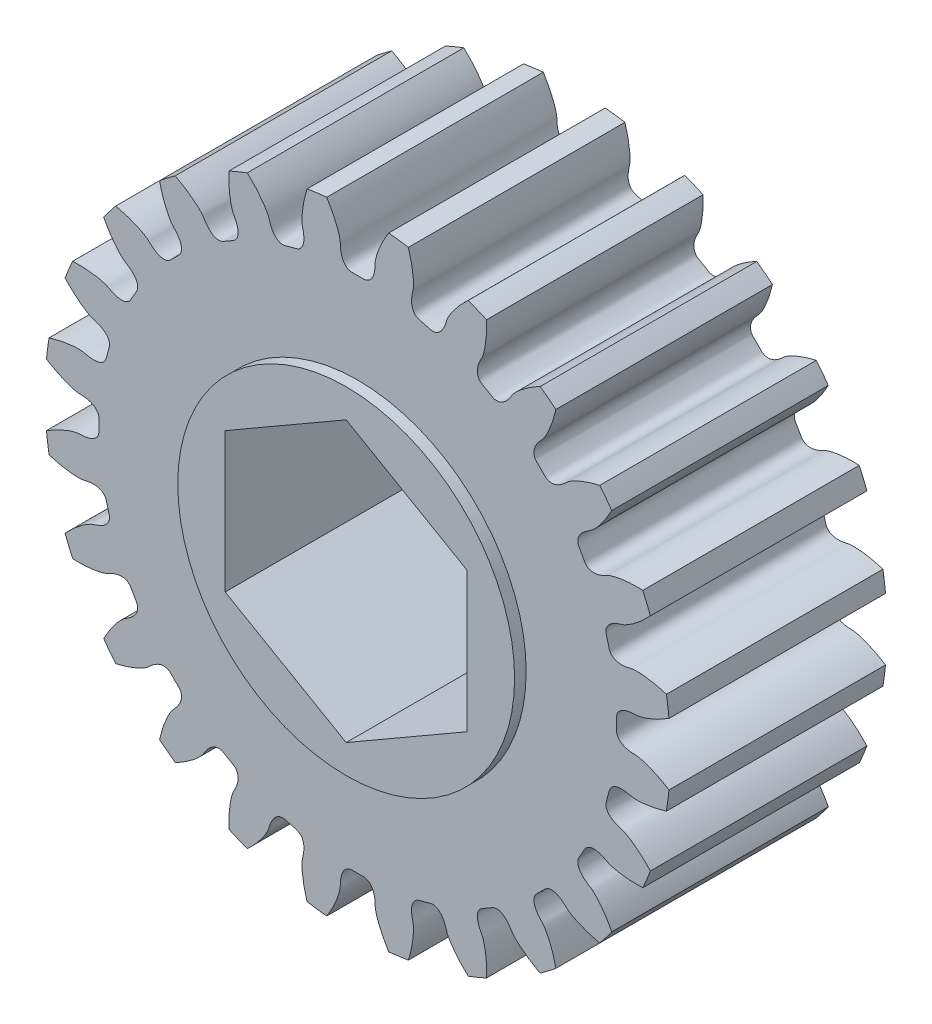
from build123d import *

# Parameters (mm, degrees)
BOSS_EXTRUDE1_DEPTH = 11.43
SKETCH2_R           = 8.89
BOSS_EXTRUDE2_DEPTH = 0.6096
BOSS_EXTRUDE3_START = 0.6096
SKETCH3_R           = 8.89
BOSS_EXTRUDE3_DEPTH = 0.6096
CUT_EXTRUDE1_DEPTH  = 27.454065155


with BuildPart() as part:
    # Sketch1 → Boss-Extrude1 (new body)
    with BuildSketch(Plane(origin=(0, 0, -5.715), x_dir=(-1, 0, 0), z_dir=(0, 0, -1))):
        with BuildLine():
            ThreePointArc((-12.77291519, 10.46101035), (-13.098263648, 10.050651193), (-13.410433779, 9.63017995))
            add(Edge.make_bspline(
                [(-15.045197369, 6.798686353), (-14.873297535, 6.805692341), (-14.649953152, 6.807138862), (-14.379005178, 6.794510105), (-14.235225084, 6.784188863), (-14.101005346, 6.771164086), (-13.976385487, 6.755908447), (-13.861387028, 6.738895015), (-13.756013949, 6.720596407), (-13.660252351, 6.701483906), (-13.574071493, 6.682028095), (-13.497420793, 6.662694288), (-13.430239616, 6.643954511), (-13.372427489, 6.626248154), (-13.296250192, 6.600877851), (-13.225703417, 6.573215282), (-13.16301586, 6.535644254), (-13.124001527, 6.514542427), (-13.085607289, 6.494262854), (-13.047639719, 6.475150065), (-13.010145976, 6.457100342), (-12.973107641, 6.440126868), (-12.93651973, 6.424213293), (-12.900369691, 6.409352026), (-12.864642271, 6.395534665), (-12.829317572, 6.382754948), (-12.79437077, 6.371008597), (-12.759771278, 6.360294137), (-12.725481913, 6.350613693), (-12.691457924, 6.341974095), (-12.657645904, 6.334388296), (-12.623982608, 6.327877232), (-12.590393703, 6.322472245), (-12.556792554, 6.318218241), (-12.523079194, 6.315177808), (-12.489139755, 6.313436524), (-12.454846838, 6.31310974), (-12.420061569, 6.314351082), (-12.384638511, 6.317362748), (-12.348435163, 6.322407349), (-12.311328424, 6.329820213), (-12.273240984, 6.340019665), (-12.234180462, 6.353510435), (-12.194292679, 6.370872195), (-12.153924918, 6.392722008), (-12.113689118, 6.419639172), (-12.074489994, 6.452046706), (-12.037524498, 6.49006511), (-12.006182734, 6.530624969), (-11.93683776, 6.644251729), (-11.83852176, 6.834973725), (-11.722509667, 7.015478876), (-11.658778493, 7.132346765), (-11.639323506, 7.179769459), (-11.624881351, 7.23079172), (-11.616415165, 7.280942924), (-11.613222117, 7.329246731), (-11.614483505, 7.375131143), (-11.619391671, 7.418355857), (-11.627238582, 7.458928646), (-11.637449318, 7.497013063), (-11.649582958, 7.532854874), (-11.66331588, 7.566730194), (-11.67841923, 7.598913294), (-11.694736831, 7.629658891), (-11.712166292, 7.659194037), (-11.730644008, 7.687715812), (-11.75013378, 7.715392222), (-11.77061843, 7.742364668), (-11.792093739, 7.768751019), (-11.814564134, 7.794648757), (-11.838039638, 7.820137926), (-11.862533745, 7.845283766), (-11.888061937, 7.870139005), (-11.914640678, 7.894745814), (-11.942286717, 7.919137457), (-11.971016626, 7.943339685), (-12.000846522, 7.967371857), (-12.031791776, 7.991248076), (-12.063867292, 8.014977349), (-12.09708592, 8.038566751), (-12.131464309, 8.062012423), (-12.167000255, 8.085336909), (-12.203759999, 8.108447508), (-12.241541884, 8.131683998), (-12.305423127, 8.167187501), (-12.364653002, 8.214451516), (-12.424712977, 8.267737839), (-12.468953197, 8.308951431), (-12.518772908, 8.357762148), (-12.573841826, 8.414476699), (-12.633781481, 8.479383605), (-12.698214192, 8.552759331), (-12.76674779, 8.63486579), (-12.838981084, 8.725950661), (-12.914502784, 8.826246805), (-12.992892441, 8.93597212), (-13.073720946, 9.055328713), (-13.220131757, 9.283662163), (-13.330551225, 9.477807333), (-13.410433779, 9.63017995)],
                knots=[0, 0, 0, 0, 0.073028032, 0.094740238, 0.115136553, 0.134216977, 0.151981509, 0.168430151, 0.183562901, 0.197379759, 0.209880727, 0.221065803, 0.230934988, 0.239488282, 0.246725684, 0.265042197, 0.271452592, 0.277728243, 0.283871565, 0.289885249, 0.295772294, 0.301536056, 0.307180296, 0.312709247, 0.318127684, 0.323441008, 0.328655347, 0.333777681, 0.338815973, 0.343779346, 0.348678271, 0.353524805, 0.358332856, 0.363118494, 0.367900306, 0.372699782, 0.377541719, 0.382454611, 0.387470953, 0.392627347, 0.397964218, 0.403524864, 0.409353442, 0.415491449, 0.42197228, 0.428813857, 0.436010122, 0.443523453, 0.451281216, 0.457711951, 0.5, 0.542288049, 0.548718784, 0.556476547, 0.563989878, 0.571186143, 0.57802772, 0.584508551, 0.590646558, 0.596475136, 0.602035782, 0.607372653, 0.612529047, 0.617545389, 0.622458281, 0.627300218, 0.632099694, 0.636881506, 0.641667144, 0.646475195, 0.651321729, 0.656220654, 0.661184027, 0.666222319, 0.671344653, 0.676558992, 0.681872316, 0.687290753, 0.692819704, 0.698463944, 0.704227706, 0.710114751, 0.716128435, 0.722271757, 0.728547408, 0.734957803, 0.753274316, 0.760511718, 0.769065012, 0.778934197, 0.790119273, 0.802620241, 0.816437099, 0.831569849, 0.848018491, 0.865783023, 0.884863447, 0.905259762, 0.926971968, 1, 1, 1, 1], degree=3))
            ThreePointArc((-15.045197369, 6.798686353), (-15.253251082, 6.318103468), (-15.445958307, 5.83116386))
            add(Edge.make_bspline(
                [(-16.29217421, 2.673043117), (-16.127945004, 2.724301333), (-15.912585283, 2.783504344), (-15.647601075, 2.841432398), (-15.506048835, 2.86867587), (-15.373031463, 2.890833526), (-15.248709473, 2.908351703), (-15.133226091, 2.921681781), (-15.026707485, 2.931279243), (-14.929262205, 2.93760291), (-14.840982354, 2.941115287), (-14.761939506, 2.942278925), (-14.692197261, 2.941565458), (-14.631772292, 2.939425309), (-14.551624356, 2.934635614), (-14.476321804, 2.926174474), (-14.406046176, 2.906108381), (-14.362899669, 2.895823234), (-14.320564944, 2.88617183), (-14.278944333, 2.877537024), (-14.238056547, 2.869806425), (-14.197887204, 2.862997535), (-14.158427259, 2.85709585), (-14.119662624, 2.852097287), (-14.08157639, 2.847997677), (-14.044147717, 2.844796124), (-14.00735152, 2.842494918), (-13.97115787, 2.841100552), (-13.935531404, 2.840624702), (-13.900430661, 2.841085547), (-13.865807409, 2.842509423), (-13.831605974, 2.84493292), (-13.79776267, 2.848405551), (-13.764205435, 2.852993117), (-13.730853908, 2.858781944), (-13.69762025, 2.865884165), (-13.664411258, 2.874444177), (-13.631132551, 2.884646311), (-13.597695981, 2.896723519), (-13.564031871, 2.910966345), (-13.530108104, 2.927730553), (-13.495958274, 2.947440222), (-13.461720375, 2.970580912), (-13.42768529, 2.997674803), (-13.394348175, 3.029228046), (-13.362450051, 3.065641821), (-13.332974292, 3.107090575), (-13.307108251, 3.153380908), (-13.287332096, 3.200670569), (-13.249758765, 3.328373391), (-13.204155286, 3.538042746), (-13.13881438, 3.742423472), (-13.107502428, 3.871804026), (-13.100984251, 3.922646151), (-13.100239733, 3.975667776), (-13.105042112, 4.02630133), (-13.11445981, 4.073785646), (-13.127553976, 4.117780114), (-13.14348228, 4.158261654), (-13.161562825, 4.195421029), (-13.18128261, 4.229565018), (-13.20227935, 4.261045131), (-13.224311912, 4.290211836), (-13.247230227, 4.317389289), (-13.270949365, 4.34286395), (-13.29542919, 4.366881633), (-13.320659272, 4.389649167), (-13.346648128, 4.411338202), (-13.373415763, 4.432089767), (-13.400988609, 4.452018806), (-13.429396172, 4.471218334), (-13.45866885, 4.489763072), (-13.488836562, 4.507712547), (-13.519927912, 4.525113682), (-13.551969715, 4.542002951), (-13.584986759, 4.558408147), (-13.619001718, 4.574349856), (-13.654035169, 4.589842607), (-13.690105609, 4.604896043), (-13.727229766, 4.619515006), (-13.765421883, 4.633703005), (-13.804697044, 4.647452003), (-13.845058953, 4.660784347), (-13.886547602, 4.673593349), (-13.929056147, 4.686259404), (-13.999949672, 4.704019472), (-14.069394166, 4.734343185), (-14.141199162, 4.770269155), (-14.194598794, 4.798628217), (-14.255354084, 4.832881459), (-14.323225379, 4.873410623), (-14.397921784, 4.920592356), (-14.479150039, 4.974791453), (-14.566599127, 5.036362401), (-14.65994563, 5.105648278), (-14.758852543, 5.18298046), (-14.862970138, 5.268678239), (-14.971936238, 5.363047898), (-15.172455267, 5.545707168), (-15.329360751, 5.70465834), (-15.445958307, 5.83116386)],
                knots=[0, 0, 0, 0, 0.073028032, 0.094740238, 0.115136553, 0.134216977, 0.151981509, 0.168430151, 0.183562901, 0.197379759, 0.209880727, 0.221065803, 0.230934988, 0.239488282, 0.246725684, 0.265042197, 0.271452592, 0.277728243, 0.283871565, 0.289885249, 0.295772294, 0.301536056, 0.307180296, 0.312709247, 0.318127684, 0.323441008, 0.328655347, 0.333777681, 0.338815973, 0.343779346, 0.348678271, 0.353524805, 0.358332856, 0.363118494, 0.367900306, 0.372699782, 0.377541719, 0.382454611, 0.387470953, 0.392627347, 0.397964218, 0.403524864, 0.409353442, 0.415491449, 0.42197228, 0.428813857, 0.436010122, 0.443523453, 0.451281216, 0.457711951, 0.5, 0.542288049, 0.548718784, 0.556476547, 0.563989878, 0.571186143, 0.57802772, 0.584508551, 0.590646558, 0.596475136, 0.602035782, 0.607372653, 0.612529047, 0.617545389, 0.622458281, 0.627300218, 0.632099694, 0.636881506, 0.641667144, 0.646475195, 0.651321729, 0.656220654, 0.661184027, 0.666222319, 0.671344653, 0.676558992, 0.681872316, 0.687290753, 0.692819704, 0.698463944, 0.704227706, 0.710114751, 0.716128435, 0.722271757, 0.728547408, 0.734957803, 0.753274316, 0.760511718, 0.769065012, 0.778934197, 0.790119273, 0.802620241, 0.816437099, 0.831569849, 0.848018491, 0.865783023, 0.884863447, 0.905259762, 0.926971968, 1, 1, 1, 1], degree=3))
            ThreePointArc((-16.29217421, 2.673043117), (-16.368754661, 2.154987434), (-16.428866303, 1.63476359))
            add(Edge.make_bspline(
                [(-16.428866303, -1.63476359), (-16.283499674, -1.54274631), (-16.090801024, -1.429821394), (-15.849838818, -1.305284232), (-15.720160982, -1.242332643), (-15.597410891, -1.186502561), (-15.481859108, -1.137404403), (-15.373760805, -1.094639238), (-15.273355738, -1.057799757), (-15.180867511, -1.02647087), (-15.096504793, -1.000229668), (-15.020456437, -0.978647885), (-14.952905942, -0.96128642), (-14.893985993, -0.947714512), (-14.815329367, -0.93159719), (-14.740402783, -0.92028029), (-14.667328252, -0.921473976), (-14.622989935, -0.920241527), (-14.579599763, -0.918607034), (-14.537162488, -0.916175409), (-14.495667094, -0.913060057), (-14.455104217, -0.909240349), (-14.415461369, -0.904727954), (-14.376723884, -0.899523169), (-14.338874349, -0.893625645), (-14.301892404, -0.887030855), (-14.265754411, -0.879730093), (-14.230433142, -0.871709341), (-14.195897459, -0.862948168), (-14.162112021, -0.853418286), (-14.129037053, -0.84308177), (-14.096628251, -0.831888869), (-14.064836913, -0.819775273), (-14.033610463, -0.806658774), (-14.00289362, -0.792435186), (-13.972630561, -0.776973463), (-13.942768632, -0.760110007), (-13.913264376, -0.741642339), (-13.884092941, -0.721322631), (-13.855262222, -0.698852205), (-13.826833276, -0.673879106), (-13.798948311, -0.646002402), (-13.771866292, -0.614788791), (-13.746003338, -0.579809174), (-13.721968739, -0.540702801), (-13.700582096, -0.497273953), (-13.682838426, -0.449608643), (-13.669834569, -0.398200991), (-13.662971734, -0.347404241), (-13.659730606, -0.214328093), (-13.66994745, 0), (-13.659730606, 0.214328093), (-13.662971734, 0.347404241), (-13.669834569, 0.398200991), (-13.682838426, 0.449608643), (-13.700582096, 0.497273953), (-13.721968739, 0.540702801), (-13.746003338, 0.579809174), (-13.771866292, 0.614788791), (-13.798948311, 0.646002402), (-13.826833276, 0.673879106), (-13.855262222, 0.698852205), (-13.884092941, 0.721322631), (-13.913264376, 0.741642339), (-13.942768632, 0.760110007), (-13.972630561, 0.776973463), (-14.00289362, 0.792435186), (-14.033610463, 0.806658774), (-14.064836913, 0.819775273), (-14.096628251, 0.831888869), (-14.129037053, 0.84308177), (-14.162112021, 0.853418286), (-14.195897459, 0.862948168), (-14.230433142, 0.871709341), (-14.265754411, 0.879730093), (-14.301892404, 0.887030855), (-14.338874349, 0.893625645), (-14.376723884, 0.899523169), (-14.415461369, 0.904727954), (-14.455104217, 0.909240349), (-14.495667094, 0.913060057), (-14.537162488, 0.916175409), (-14.579599763, 0.918607034), (-14.622989935, 0.920241527), (-14.667328252, 0.921473976), (-14.740402783, 0.92028029), (-14.815329367, 0.93159719), (-14.893985993, 0.947714512), (-14.952905942, 0.96128642), (-15.020456437, 0.978647885), (-15.096504793, 1.000229668), (-15.180867511, 1.02647087), (-15.273355738, 1.057799757), (-15.373760805, 1.094639238), (-15.481859108, 1.137404403), (-15.597410891, 1.186502561), (-15.720160982, 1.242332643), (-15.849838818, 1.305284232), (-16.090801024, 1.429821394), (-16.283499674, 1.54274631), (-16.428866303, 1.63476359)],
                knots=[0, 0, 0, 0, 0.073028032, 0.094740238, 0.115136553, 0.134216977, 0.151981509, 0.168430151, 0.183562901, 0.197379759, 0.209880727, 0.221065803, 0.230934988, 0.239488282, 0.246725684, 0.265042197, 0.271452592, 0.277728243, 0.283871565, 0.289885249, 0.295772294, 0.301536056, 0.307180296, 0.312709247, 0.318127684, 0.323441008, 0.328655347, 0.333777681, 0.338815973, 0.343779346, 0.348678271, 0.353524805, 0.358332856, 0.363118494, 0.367900306, 0.372699782, 0.377541719, 0.382454611, 0.387470953, 0.392627347, 0.397964218, 0.403524864, 0.409353442, 0.415491449, 0.42197228, 0.428813857, 0.436010122, 0.443523453, 0.451281216, 0.457711951, 0.5, 0.542288049, 0.548718784, 0.556476547, 0.563989878, 0.571186143, 0.57802772, 0.584508551, 0.590646558, 0.596475136, 0.602035782, 0.607372653, 0.612529047, 0.617545389, 0.622458281, 0.627300218, 0.632099694, 0.636881506, 0.641667144, 0.646475195, 0.651321729, 0.656220654, 0.661184027, 0.666222319, 0.671344653, 0.676558992, 0.681872316, 0.687290753, 0.692819704, 0.698463944, 0.704227706, 0.710114751, 0.716128435, 0.722271757, 0.728547408, 0.734957803, 0.753274316, 0.760511718, 0.769065012, 0.778934197, 0.790119273, 0.802620241, 0.816437099, 0.831569849, 0.848018491, 0.865783023, 0.884863447, 0.905259762, 0.926971968, 1, 1, 1, 1], degree=3))
            ThreePointArc((-16.428866303, -1.63476359), (-16.368754661, -2.154987434), (-16.29217421, -2.673043117))
            add(Edge.make_bspline(
                [(-15.445958307, -5.83116386), (-15.329360751, -5.70465834), (-15.172455267, -5.545707168), (-14.971936238, -5.363047898), (-14.862970138, -5.268678239), (-14.758852543, -5.18298046), (-14.65994563, -5.105648278), (-14.566599127, -5.036362401), (-14.479150039, -4.974791453), (-14.397921784, -4.920592356), (-14.323225379, -4.873410623), (-14.255354084, -4.832881459), (-14.194598794, -4.798628217), (-14.141199162, -4.770269155), (-14.069394166, -4.734343185), (-13.999949672, -4.704019472), (-13.929056147, -4.686259404), (-13.886547602, -4.673593349), (-13.845058953, -4.660784347), (-13.804697044, -4.647452003), (-13.765421883, -4.633703005), (-13.727229766, -4.619515006), (-13.690105609, -4.604896043), (-13.654035169, -4.589842607), (-13.619001718, -4.574349856), (-13.584986759, -4.558408147), (-13.551969715, -4.542002951), (-13.519927912, -4.525113682), (-13.488836562, -4.507712547), (-13.45866885, -4.489763072), (-13.429396172, -4.471218334), (-13.400988609, -4.452018806), (-13.373415763, -4.432089767), (-13.346648128, -4.411338202), (-13.320659272, -4.389649167), (-13.29542919, -4.366881633), (-13.270949365, -4.34286395), (-13.247230227, -4.317389289), (-13.224311912, -4.290211836), (-13.20227935, -4.261045131), (-13.18128261, -4.229565018), (-13.161562825, -4.195421029), (-13.14348228, -4.158261654), (-13.127553976, -4.117780114), (-13.11445981, -4.073785646), (-13.105042112, -4.02630133), (-13.100239733, -3.975667776), (-13.100984251, -3.922646151), (-13.107502428, -3.871804026), (-13.13881438, -3.742423472), (-13.204155286, -3.538042746), (-13.249758765, -3.328373391), (-13.287332096, -3.200670569), (-13.307108251, -3.153380908), (-13.332974292, -3.107090575), (-13.362450051, -3.065641821), (-13.394348175, -3.029228046), (-13.42768529, -2.997674803), (-13.461720375, -2.970580912), (-13.495958274, -2.947440222), (-13.530108104, -2.927730553), (-13.564031871, -2.910966345), (-13.597695981, -2.896723519), (-13.631132551, -2.884646311), (-13.664411258, -2.874444177), (-13.69762025, -2.865884165), (-13.730853908, -2.858781944), (-13.764205435, -2.852993117), (-13.79776267, -2.848405551), (-13.831605974, -2.84493292), (-13.865807409, -2.842509423), (-13.900430661, -2.841085547), (-13.935531404, -2.840624702), (-13.97115787, -2.841100552), (-14.00735152, -2.842494918), (-14.044147717, -2.844796124), (-14.08157639, -2.847997677), (-14.119662624, -2.852097287), (-14.158427259, -2.85709585), (-14.197887204, -2.862997535), (-14.238056547, -2.869806425), (-14.278944333, -2.877537024), (-14.320564944, -2.88617183), (-14.362899669, -2.895823234), (-14.406046176, -2.906108381), (-14.476321804, -2.926174474), (-14.551624356, -2.934635614), (-14.631772292, -2.939425309), (-14.692197261, -2.941565458), (-14.761939506, -2.942278925), (-14.840982354, -2.941115287), (-14.929262205, -2.93760291), (-15.026707485, -2.931279243), (-15.133226091, -2.921681781), (-15.248709473, -2.908351703), (-15.373031463, -2.890833526), (-15.506048835, -2.86867587), (-15.647601075, -2.841432398), (-15.912585283, -2.783504344), (-16.127945004, -2.724301333), (-16.29217421, -2.673043117)],
                knots=[0, 0, 0, 0, 0.073028032, 0.094740238, 0.115136553, 0.134216977, 0.151981509, 0.168430151, 0.183562901, 0.197379759, 0.209880727, 0.221065803, 0.230934988, 0.239488282, 0.246725684, 0.265042197, 0.271452592, 0.277728243, 0.283871565, 0.289885249, 0.295772294, 0.301536056, 0.307180296, 0.312709247, 0.318127684, 0.323441008, 0.328655347, 0.333777681, 0.338815973, 0.343779346, 0.348678271, 0.353524805, 0.358332856, 0.363118494, 0.367900306, 0.372699782, 0.377541719, 0.382454611, 0.387470953, 0.392627347, 0.397964218, 0.403524864, 0.409353442, 0.415491449, 0.42197228, 0.428813857, 0.436010122, 0.443523453, 0.451281216, 0.457711951, 0.5, 0.542288049, 0.548718784, 0.556476547, 0.563989878, 0.571186143, 0.57802772, 0.584508551, 0.590646558, 0.596475136, 0.602035782, 0.607372653, 0.612529047, 0.617545389, 0.622458281, 0.627300218, 0.632099694, 0.636881506, 0.641667144, 0.646475195, 0.651321729, 0.656220654, 0.661184027, 0.666222319, 0.671344653, 0.676558992, 0.681872316, 0.687290753, 0.692819704, 0.698463944, 0.704227706, 0.710114751, 0.716128435, 0.722271757, 0.728547408, 0.734957803, 0.753274316, 0.760511718, 0.769065012, 0.778934197, 0.790119273, 0.802620241, 0.816437099, 0.831569849, 0.848018491, 0.865783023, 0.884863447, 0.905259762, 0.926971968, 1, 1, 1, 1], degree=3))
            ThreePointArc((-15.445958307, -5.83116386), (-15.253251082, -6.318103468), (-15.045197369, -6.798686353))
            add(Edge.make_bspline(
                [(-13.410433779, -9.63017995), (-13.330551225, -9.477807333), (-13.220131757, -9.283662163), (-13.073720946, -9.055328713), (-12.992892441, -8.93597212), (-12.914502784, -8.826246805), (-12.838981084, -8.725950661), (-12.76674779, -8.63486579), (-12.698214192, -8.552759331), (-12.633781481, -8.479383605), (-12.573841826, -8.414476699), (-12.518772908, -8.357762148), (-12.468953197, -8.308951431), (-12.424712977, -8.267737839), (-12.364653002, -8.214451516), (-12.305423127, -8.167187501), (-12.241541884, -8.131683998), (-12.203759999, -8.108447508), (-12.167000255, -8.085336909), (-12.131464309, -8.062012423), (-12.09708592, -8.038566751), (-12.063867292, -8.014977349), (-12.031791776, -7.991248076), (-12.000846522, -7.967371857), (-11.971016626, -7.943339685), (-11.942286717, -7.919137457), (-11.914640678, -7.894745814), (-11.888061937, -7.870139005), (-11.862533745, -7.845283766), (-11.838039638, -7.820137926), (-11.814564134, -7.794648757), (-11.792093739, -7.768751019), (-11.77061843, -7.742364668), (-11.75013378, -7.715392222), (-11.730644008, -7.687715812), (-11.712166292, -7.659194037), (-11.694736831, -7.629658891), (-11.67841923, -7.598913294), (-11.66331588, -7.566730194), (-11.649582958, -7.532854874), (-11.637449318, -7.497013063), (-11.627238582, -7.458928646), (-11.619391671, -7.418355857), (-11.614483505, -7.375131143), (-11.613222117, -7.329246731), (-11.616415165, -7.280942924), (-11.624881351, -7.23079172), (-11.639323506, -7.179769459), (-11.658778493, -7.132346765), (-11.722509667, -7.015478876), (-11.83852176, -6.834973725), (-11.93683776, -6.644251729), (-12.006182734, -6.530624969), (-12.037524498, -6.49006511), (-12.074489994, -6.452046706), (-12.113689118, -6.419639172), (-12.153924918, -6.392722008), (-12.194292679, -6.370872195), (-12.234180462, -6.353510435), (-12.273240984, -6.340019665), (-12.311328424, -6.329820213), (-12.348435163, -6.322407349), (-12.384638511, -6.317362748), (-12.420061569, -6.314351082), (-12.454846838, -6.31310974), (-12.489139755, -6.313436524), (-12.523079194, -6.315177808), (-12.556792554, -6.318218241), (-12.590393703, -6.322472245), (-12.623982608, -6.327877232), (-12.657645904, -6.334388296), (-12.691457924, -6.341974095), (-12.725481913, -6.350613693), (-12.759771278, -6.360294137), (-12.79437077, -6.371008597), (-12.829317572, -6.382754948), (-12.864642271, -6.395534665), (-12.900369691, -6.409352026), (-12.93651973, -6.424213293), (-12.973107641, -6.440126868), (-13.010145976, -6.457100342), (-13.047639719, -6.475150065), (-13.085607289, -6.494262854), (-13.124001527, -6.514542427), (-13.16301586, -6.535644254), (-13.225703417, -6.573215282), (-13.296250192, -6.600877851), (-13.372427489, -6.626248154), (-13.430239616, -6.643954511), (-13.497420793, -6.662694288), (-13.574071493, -6.682028095), (-13.660252351, -6.701483906), (-13.756013949, -6.720596407), (-13.861387028, -6.738895015), (-13.976385487, -6.755908447), (-14.101005346, -6.771164086), (-14.235225084, -6.784188863), (-14.379005178, -6.794510105), (-14.649953152, -6.807138862), (-14.873297535, -6.805692341), (-15.045197369, -6.798686353)],
                knots=[0, 0, 0, 0, 0.073028032, 0.094740238, 0.115136553, 0.134216977, 0.151981509, 0.168430151, 0.183562901, 0.197379759, 0.209880727, 0.221065803, 0.230934988, 0.239488282, 0.246725684, 0.265042197, 0.271452592, 0.277728243, 0.283871565, 0.289885249, 0.295772294, 0.301536056, 0.307180296, 0.312709247, 0.318127684, 0.323441008, 0.328655347, 0.333777681, 0.338815973, 0.343779346, 0.348678271, 0.353524805, 0.358332856, 0.363118494, 0.367900306, 0.372699782, 0.377541719, 0.382454611, 0.387470953, 0.392627347, 0.397964218, 0.403524864, 0.409353442, 0.415491449, 0.42197228, 0.428813857, 0.436010122, 0.443523453, 0.451281216, 0.457711951, 0.5, 0.542288049, 0.548718784, 0.556476547, 0.563989878, 0.571186143, 0.57802772, 0.584508551, 0.590646558, 0.596475136, 0.602035782, 0.607372653, 0.612529047, 0.617545389, 0.622458281, 0.627300218, 0.632099694, 0.636881506, 0.641667144, 0.646475195, 0.651321729, 0.656220654, 0.661184027, 0.666222319, 0.671344653, 0.676558992, 0.681872316, 0.687290753, 0.692819704, 0.698463944, 0.704227706, 0.710114751, 0.716128435, 0.722271757, 0.728547408, 0.734957803, 0.753274316, 0.760511718, 0.769065012, 0.778934197, 0.790119273, 0.802620241, 0.816437099, 0.831569849, 0.848018491, 0.865783023, 0.884863447, 0.905259762, 0.926971968, 1, 1, 1, 1], degree=3))
            ThreePointArc((-13.410433779, -9.63017995), (-13.098263648, -10.050651193), (-12.77291519, -10.46101035))
            add(Edge.make_bspline(
                [(-10.46101035, -12.77291519), (-10.423286664, -12.605059418), (-10.366878115, -12.388950923), (-10.284553177, -12.130503841), (-10.237370596, -11.994294268), (-10.190051003, -11.868019017), (-10.143061194, -11.751593927), (-10.09686369, -11.644917346), (-10.051916032, -11.547870796), (-10.008669849, -11.460318874), (-9.967571731, -11.382110092), (-9.929058047, -11.313075159), (-9.893569044, -11.253033336), (-9.861503136, -11.201773852), (-9.817281171, -11.134758552), (-9.772302332, -11.073775199), (-9.719786772, -11.022947766), (-9.68930632, -10.990724369), (-9.659780596, -10.958887123), (-9.63149233, -10.92716002), (-9.604353542, -10.895615458), (-9.578372198, -10.864232231), (-9.553531217, -10.833009759), (-9.529820017, -10.801937882), (-9.507226533, -10.77100404), (-9.48573957, -10.740190636), (-9.465348569, -10.709474797), (-9.446044188, -10.67882736), (-9.427818856, -10.64821186), (-9.410667589, -10.617583303), (-9.394589075, -10.586886749), (-9.379587168, -10.556055689), (-9.365672903, -10.525010212), (-9.352867233, -10.493655012), (-9.341204741, -10.461877328), (-9.330738616, -10.429545025), (-9.321547308, -10.396505188), (-9.313743262, -10.362583916), (-9.307484146, -10.327588394), (-9.30298674, -10.291313005), (-9.300543086, -10.253552058), (-9.300537245, -10.214122603), (-9.303458722, -10.172901368), (-9.309905176, -10.129879174), (-9.320562529, -10.085231764), (-9.336148722, -10.039400291), (-9.357306516, -9.993149157), (-9.3844621, -9.947603342), (-9.41552807, -9.906831859), (-9.507335292, -9.810440989), (-9.666112541, -9.666112541), (-9.810440989, -9.507335292), (-9.906831859, -9.41552807), (-9.947603342, -9.3844621), (-9.993149157, -9.357306516), (-10.039400291, -9.336148722), (-10.085231764, -9.320562529), (-10.129879174, -9.309905176), (-10.172901368, -9.303458722), (-10.214122603, -9.300537245), (-10.253552058, -9.300543086), (-10.291313005, -9.30298674), (-10.327588394, -9.307484146), (-10.362583916, -9.313743262), (-10.396505188, -9.321547308), (-10.429545025, -9.330738616), (-10.461877328, -9.341204741), (-10.493655012, -9.352867233), (-10.525010212, -9.365672903), (-10.556055689, -9.379587168), (-10.586886749, -9.394589075), (-10.617583303, -9.410667589), (-10.64821186, -9.427818856), (-10.67882736, -9.446044188), (-10.709474797, -9.465348569), (-10.740190636, -9.48573957), (-10.77100404, -9.507226533), (-10.801937882, -9.529820017), (-10.833009759, -9.553531217), (-10.864232231, -9.578372198), (-10.895615458, -9.604353542), (-10.92716002, -9.63149233), (-10.958887123, -9.659780596), (-10.990724369, -9.68930632), (-11.022947766, -9.719786772), (-11.073775199, -9.772302332), (-11.134758552, -9.817281171), (-11.201773852, -9.861503136), (-11.253033336, -9.893569044), (-11.313075159, -9.929058047), (-11.382110092, -9.967571731), (-11.460318874, -10.008669849), (-11.547870796, -10.051916032), (-11.644917346, -10.09686369), (-11.751593927, -10.143061194), (-11.868019017, -10.190051003), (-11.994294268, -10.237370596), (-12.130503841, -10.284553177), (-12.388950923, -10.366878115), (-12.605059418, -10.423286664), (-12.77291519, -10.46101035)],
                knots=[0, 0, 0, 0, 0.073028032, 0.094740238, 0.115136553, 0.134216977, 0.151981509, 0.168430151, 0.183562901, 0.197379759, 0.209880727, 0.221065803, 0.230934988, 0.239488282, 0.246725684, 0.265042197, 0.271452592, 0.277728243, 0.283871565, 0.289885249, 0.295772294, 0.301536056, 0.307180296, 0.312709247, 0.318127684, 0.323441008, 0.328655347, 0.333777681, 0.338815973, 0.343779346, 0.348678271, 0.353524805, 0.358332856, 0.363118494, 0.367900306, 0.372699782, 0.377541719, 0.382454611, 0.387470953, 0.392627347, 0.397964218, 0.403524864, 0.409353442, 0.415491449, 0.42197228, 0.428813857, 0.436010122, 0.443523453, 0.451281216, 0.457711951, 0.5, 0.542288049, 0.548718784, 0.556476547, 0.563989878, 0.571186143, 0.57802772, 0.584508551, 0.590646558, 0.596475136, 0.602035782, 0.607372653, 0.612529047, 0.617545389, 0.622458281, 0.627300218, 0.632099694, 0.636881506, 0.641667144, 0.646475195, 0.651321729, 0.656220654, 0.661184027, 0.666222319, 0.671344653, 0.676558992, 0.681872316, 0.687290753, 0.692819704, 0.698463944, 0.704227706, 0.710114751, 0.716128435, 0.722271757, 0.728547408, 0.734957803, 0.753274316, 0.760511718, 0.769065012, 0.778934197, 0.790119273, 0.802620241, 0.816437099, 0.831569849, 0.848018491, 0.865783023, 0.884863447, 0.905259762, 0.926971968, 1, 1, 1, 1], degree=3))
            ThreePointArc((-10.46101035, -12.77291519), (-10.050651193, -13.098263648), (-9.63017995, -13.410433779))
            add(Edge.make_bspline(
                [(-6.798686353, -15.045197369), (-6.805692341, -14.873297535), (-6.807138862, -14.649953152), (-6.794510105, -14.379005178), (-6.784188863, -14.235225084), (-6.771164086, -14.101005346), (-6.755908447, -13.976385487), (-6.738895015, -13.861387028), (-6.720596407, -13.756013949), (-6.701483906, -13.660252351), (-6.682028095, -13.574071493), (-6.662694288, -13.497420793), (-6.643954511, -13.430239616), (-6.626248154, -13.372427489), (-6.600877851, -13.296250192), (-6.573215282, -13.225703417), (-6.535644254, -13.16301586), (-6.514542427, -13.124001527), (-6.494262854, -13.085607289), (-6.475150065, -13.047639719), (-6.457100342, -13.010145976), (-6.440126868, -12.973107641), (-6.424213293, -12.93651973), (-6.409352026, -12.900369691), (-6.395534665, -12.864642271), (-6.382754948, -12.829317572), (-6.371008597, -12.79437077), (-6.360294137, -12.759771278), (-6.350613693, -12.725481913), (-6.341974095, -12.691457924), (-6.334388296, -12.657645904), (-6.327877232, -12.623982608), (-6.322472245, -12.590393703), (-6.318218241, -12.556792554), (-6.315177808, -12.523079194), (-6.313436524, -12.489139755), (-6.31310974, -12.454846838), (-6.314351082, -12.420061569), (-6.317362748, -12.384638511), (-6.322407349, -12.348435163), (-6.329820213, -12.311328424), (-6.340019665, -12.273240984), (-6.353510435, -12.234180462), (-6.370872195, -12.194292679), (-6.392722008, -12.153924918), (-6.419639172, -12.113689118), (-6.452046706, -12.074489994), (-6.49006511, -12.037524498), (-6.530624969, -12.006182734), (-6.644251729, -11.93683776), (-6.834973725, -11.83852176), (-7.015478876, -11.722509667), (-7.132346765, -11.658778493), (-7.179769459, -11.639323506), (-7.23079172, -11.624881351), (-7.280942924, -11.616415165), (-7.329246731, -11.613222117), (-7.375131143, -11.614483505), (-7.418355857, -11.619391671), (-7.458928646, -11.627238582), (-7.497013063, -11.637449318), (-7.532854874, -11.649582958), (-7.566730194, -11.66331588), (-7.598913294, -11.67841923), (-7.629658891, -11.694736831), (-7.659194037, -11.712166292), (-7.687715812, -11.730644008), (-7.715392222, -11.75013378), (-7.742364668, -11.77061843), (-7.768751019, -11.792093739), (-7.794648757, -11.814564134), (-7.820137926, -11.838039638), (-7.845283766, -11.862533745), (-7.870139005, -11.888061937), (-7.894745814, -11.914640678), (-7.919137457, -11.942286717), (-7.943339685, -11.971016626), (-7.967371857, -12.000846522), (-7.991248076, -12.031791776), (-8.014977349, -12.063867292), (-8.038566751, -12.09708592), (-8.062012423, -12.131464309), (-8.085336909, -12.167000255), (-8.108447508, -12.203759999), (-8.131683998, -12.241541884), (-8.167187501, -12.305423127), (-8.214451516, -12.364653002), (-8.267737839, -12.424712977), (-8.308951431, -12.468953197), (-8.357762148, -12.518772908), (-8.414476699, -12.573841826), (-8.479383605, -12.633781481), (-8.552759331, -12.698214192), (-8.63486579, -12.76674779), (-8.725950661, -12.838981084), (-8.826246805, -12.914502784), (-8.93597212, -12.992892441), (-9.055328713, -13.073720946), (-9.283662163, -13.220131757), (-9.477807333, -13.330551225), (-9.63017995, -13.410433779)],
                knots=[0, 0, 0, 0, 0.073028032, 0.094740238, 0.115136553, 0.134216977, 0.151981509, 0.168430151, 0.183562901, 0.197379759, 0.209880727, 0.221065803, 0.230934988, 0.239488282, 0.246725684, 0.265042197, 0.271452592, 0.277728243, 0.283871565, 0.289885249, 0.295772294, 0.301536056, 0.307180296, 0.312709247, 0.318127684, 0.323441008, 0.328655347, 0.333777681, 0.338815973, 0.343779346, 0.348678271, 0.353524805, 0.358332856, 0.363118494, 0.367900306, 0.372699782, 0.377541719, 0.382454611, 0.387470953, 0.392627347, 0.397964218, 0.403524864, 0.409353442, 0.415491449, 0.42197228, 0.428813857, 0.436010122, 0.443523453, 0.451281216, 0.457711951, 0.5, 0.542288049, 0.548718784, 0.556476547, 0.563989878, 0.571186143, 0.57802772, 0.584508551, 0.590646558, 0.596475136, 0.602035782, 0.607372653, 0.612529047, 0.617545389, 0.622458281, 0.627300218, 0.632099694, 0.636881506, 0.641667144, 0.646475195, 0.651321729, 0.656220654, 0.661184027, 0.666222319, 0.671344653, 0.676558992, 0.681872316, 0.687290753, 0.692819704, 0.698463944, 0.704227706, 0.710114751, 0.716128435, 0.722271757, 0.728547408, 0.734957803, 0.753274316, 0.760511718, 0.769065012, 0.778934197, 0.790119273, 0.802620241, 0.816437099, 0.831569849, 0.848018491, 0.865783023, 0.884863447, 0.905259762, 0.926971968, 1, 1, 1, 1], degree=3))
            ThreePointArc((-6.798686353, -15.045197369), (-6.318103468, -15.253251082), (-5.83116386, -15.445958307))
            add(Edge.make_bspline(
                [(-2.673043117, -16.29217421), (-2.724301333, -16.127945004), (-2.783504344, -15.912585283), (-2.841432398, -15.647601075), (-2.86867587, -15.506048835), (-2.890833526, -15.373031463), (-2.908351703, -15.248709473), (-2.921681781, -15.133226091), (-2.931279243, -15.026707485), (-2.93760291, -14.929262205), (-2.941115287, -14.840982354), (-2.942278925, -14.761939506), (-2.941565458, -14.692197261), (-2.939425309, -14.631772292), (-2.934635614, -14.551624356), (-2.926174474, -14.476321804), (-2.906108381, -14.406046176), (-2.895823234, -14.362899669), (-2.88617183, -14.320564944), (-2.877537024, -14.278944333), (-2.869806425, -14.238056547), (-2.862997535, -14.197887204), (-2.85709585, -14.158427259), (-2.852097287, -14.119662624), (-2.847997677, -14.08157639), (-2.844796124, -14.044147717), (-2.842494918, -14.00735152), (-2.841100552, -13.97115787), (-2.840624702, -13.935531404), (-2.841085547, -13.900430661), (-2.842509423, -13.865807409), (-2.84493292, -13.831605974), (-2.848405551, -13.79776267), (-2.852993117, -13.764205435), (-2.858781944, -13.730853908), (-2.865884165, -13.69762025), (-2.874444177, -13.664411258), (-2.884646311, -13.631132551), (-2.896723519, -13.597695981), (-2.910966345, -13.564031871), (-2.927730553, -13.530108104), (-2.947440222, -13.495958274), (-2.970580912, -13.461720375), (-2.997674803, -13.42768529), (-3.029228046, -13.394348175), (-3.065641821, -13.362450051), (-3.107090575, -13.332974292), (-3.153380908, -13.307108251), (-3.200670569, -13.287332096), (-3.328373391, -13.249758765), (-3.538042746, -13.204155286), (-3.742423472, -13.13881438), (-3.871804026, -13.107502428), (-3.922646151, -13.100984251), (-3.975667776, -13.100239733), (-4.02630133, -13.105042112), (-4.073785646, -13.11445981), (-4.117780114, -13.127553976), (-4.158261654, -13.14348228), (-4.195421029, -13.161562825), (-4.229565018, -13.18128261), (-4.261045131, -13.20227935), (-4.290211836, -13.224311912), (-4.317389289, -13.247230227), (-4.34286395, -13.270949365), (-4.366881633, -13.29542919), (-4.389649167, -13.320659272), (-4.411338202, -13.346648128), (-4.432089767, -13.373415763), (-4.452018806, -13.400988609), (-4.471218334, -13.429396172), (-4.489763072, -13.45866885), (-4.507712547, -13.488836562), (-4.525113682, -13.519927912), (-4.542002951, -13.551969715), (-4.558408147, -13.584986759), (-4.574349856, -13.619001718), (-4.589842607, -13.654035169), (-4.604896043, -13.690105609), (-4.619515006, -13.727229766), (-4.633703005, -13.765421883), (-4.647452003, -13.804697044), (-4.660784347, -13.845058953), (-4.673593349, -13.886547602), (-4.686259404, -13.929056147), (-4.704019472, -13.999949672), (-4.734343185, -14.069394166), (-4.770269155, -14.141199162), (-4.798628217, -14.194598794), (-4.832881459, -14.255354084), (-4.873410623, -14.323225379), (-4.920592356, -14.397921784), (-4.974791453, -14.479150039), (-5.036362401, -14.566599127), (-5.105648278, -14.65994563), (-5.18298046, -14.758852543), (-5.268678239, -14.862970138), (-5.363047898, -14.971936238), (-5.545707168, -15.172455267), (-5.70465834, -15.329360751), (-5.83116386, -15.445958307)],
                knots=[0, 0, 0, 0, 0.073028032, 0.094740238, 0.115136553, 0.134216977, 0.151981509, 0.168430151, 0.183562901, 0.197379759, 0.209880727, 0.221065803, 0.230934988, 0.239488282, 0.246725684, 0.265042197, 0.271452592, 0.277728243, 0.283871565, 0.289885249, 0.295772294, 0.301536056, 0.307180296, 0.312709247, 0.318127684, 0.323441008, 0.328655347, 0.333777681, 0.338815973, 0.343779346, 0.348678271, 0.353524805, 0.358332856, 0.363118494, 0.367900306, 0.372699782, 0.377541719, 0.382454611, 0.387470953, 0.392627347, 0.397964218, 0.403524864, 0.409353442, 0.415491449, 0.42197228, 0.428813857, 0.436010122, 0.443523453, 0.451281216, 0.457711951, 0.5, 0.542288049, 0.548718784, 0.556476547, 0.563989878, 0.571186143, 0.57802772, 0.584508551, 0.590646558, 0.596475136, 0.602035782, 0.607372653, 0.612529047, 0.617545389, 0.622458281, 0.627300218, 0.632099694, 0.636881506, 0.641667144, 0.646475195, 0.651321729, 0.656220654, 0.661184027, 0.666222319, 0.671344653, 0.676558992, 0.681872316, 0.687290753, 0.692819704, 0.698463944, 0.704227706, 0.710114751, 0.716128435, 0.722271757, 0.728547408, 0.734957803, 0.753274316, 0.760511718, 0.769065012, 0.778934197, 0.790119273, 0.802620241, 0.816437099, 0.831569849, 0.848018491, 0.865783023, 0.884863447, 0.905259762, 0.926971968, 1, 1, 1, 1], degree=3))
            ThreePointArc((-2.673043117, -16.29217421), (-2.154987434, -16.368754661), (-1.63476359, -16.428866303))
            add(Edge.make_bspline(
                [(1.63476359, -16.428866303), (1.54274631, -16.283499674), (1.429821394, -16.090801024), (1.305284232, -15.849838818), (1.242332643, -15.720160982), (1.186502561, -15.597410891), (1.137404403, -15.481859108), (1.094639238, -15.373760805), (1.057799757, -15.273355738), (1.02647087, -15.180867511), (1.000229668, -15.096504793), (0.978647885, -15.020456437), (0.96128642, -14.952905942), (0.947714512, -14.893985993), (0.93159719, -14.815329367), (0.92028029, -14.740402783), (0.921473976, -14.667328252), (0.920241527, -14.622989935), (0.918607034, -14.579599763), (0.916175409, -14.537162488), (0.913060057, -14.495667094), (0.909240349, -14.455104217), (0.904727954, -14.415461369), (0.899523169, -14.376723884), (0.893625645, -14.338874349), (0.887030855, -14.301892404), (0.879730093, -14.265754411), (0.871709341, -14.230433142), (0.862948168, -14.195897459), (0.853418286, -14.162112021), (0.84308177, -14.129037053), (0.831888869, -14.096628251), (0.819775273, -14.064836913), (0.806658774, -14.033610463), (0.792435186, -14.00289362), (0.776973463, -13.972630561), (0.760110007, -13.942768632), (0.741642339, -13.913264376), (0.721322631, -13.884092941), (0.698852205, -13.855262222), (0.673879106, -13.826833276), (0.646002402, -13.798948311), (0.614788791, -13.771866292), (0.579809174, -13.746003338), (0.540702801, -13.721968739), (0.497273953, -13.700582096), (0.449608643, -13.682838426), (0.398200991, -13.669834569), (0.347404241, -13.662971734), (0.214328093, -13.659730606), (0, -13.66994745), (-0.214328093, -13.659730606), (-0.347404241, -13.662971734), (-0.398200991, -13.669834569), (-0.449608643, -13.682838426), (-0.497273953, -13.700582096), (-0.540702801, -13.721968739), (-0.579809174, -13.746003338), (-0.614788791, -13.771866292), (-0.646002402, -13.798948311), (-0.673879106, -13.826833276), (-0.698852205, -13.855262222), (-0.721322631, -13.884092941), (-0.741642339, -13.913264376), (-0.760110007, -13.942768632), (-0.776973463, -13.972630561), (-0.792435186, -14.00289362), (-0.806658774, -14.033610463), (-0.819775273, -14.064836913), (-0.831888869, -14.096628251), (-0.84308177, -14.129037053), (-0.853418286, -14.162112021), (-0.862948168, -14.195897459), (-0.871709341, -14.230433142), (-0.879730093, -14.265754411), (-0.887030855, -14.301892404), (-0.893625645, -14.338874349), (-0.899523169, -14.376723884), (-0.904727954, -14.415461369), (-0.909240349, -14.455104217), (-0.913060057, -14.495667094), (-0.916175409, -14.537162488), (-0.918607034, -14.579599763), (-0.920241527, -14.622989935), (-0.921473976, -14.667328252), (-0.92028029, -14.740402783), (-0.93159719, -14.815329367), (-0.947714512, -14.893985993), (-0.96128642, -14.952905942), (-0.978647885, -15.020456437), (-1.000229668, -15.096504793), (-1.02647087, -15.180867511), (-1.057799757, -15.273355738), (-1.094639238, -15.373760805), (-1.137404403, -15.481859108), (-1.186502561, -15.597410891), (-1.242332643, -15.720160982), (-1.305284232, -15.849838818), (-1.429821394, -16.090801024), (-1.54274631, -16.283499674), (-1.63476359, -16.428866303)],
                knots=[0, 0, 0, 0, 0.073028032, 0.094740238, 0.115136553, 0.134216977, 0.151981509, 0.168430151, 0.183562901, 0.197379759, 0.209880727, 0.221065803, 0.230934988, 0.239488282, 0.246725684, 0.265042197, 0.271452592, 0.277728243, 0.283871565, 0.289885249, 0.295772294, 0.301536056, 0.307180296, 0.312709247, 0.318127684, 0.323441008, 0.328655347, 0.333777681, 0.338815973, 0.343779346, 0.348678271, 0.353524805, 0.358332856, 0.363118494, 0.367900306, 0.372699782, 0.377541719, 0.382454611, 0.387470953, 0.392627347, 0.397964218, 0.403524864, 0.409353442, 0.415491449, 0.42197228, 0.428813857, 0.436010122, 0.443523453, 0.451281216, 0.457711951, 0.5, 0.542288049, 0.548718784, 0.556476547, 0.563989878, 0.571186143, 0.57802772, 0.584508551, 0.590646558, 0.596475136, 0.602035782, 0.607372653, 0.612529047, 0.617545389, 0.622458281, 0.627300218, 0.632099694, 0.636881506, 0.641667144, 0.646475195, 0.651321729, 0.656220654, 0.661184027, 0.666222319, 0.671344653, 0.676558992, 0.681872316, 0.687290753, 0.692819704, 0.698463944, 0.704227706, 0.710114751, 0.716128435, 0.722271757, 0.728547408, 0.734957803, 0.753274316, 0.760511718, 0.769065012, 0.778934197, 0.790119273, 0.802620241, 0.816437099, 0.831569849, 0.848018491, 0.865783023, 0.884863447, 0.905259762, 0.926971968, 1, 1, 1, 1], degree=3))
            ThreePointArc((1.63476359, -16.428866303), (2.154987434, -16.368754661), (2.673043117, -16.29217421))
            add(Edge.make_bspline(
                [(5.83116386, -15.445958307), (5.70465834, -15.329360751), (5.545707168, -15.172455267), (5.363047898, -14.971936238), (5.268678239, -14.862970138), (5.18298046, -14.758852543), (5.105648278, -14.65994563), (5.036362401, -14.566599127), (4.974791453, -14.479150039), (4.920592356, -14.397921784), (4.873410623, -14.323225379), (4.832881459, -14.255354084), (4.798628217, -14.194598794), (4.770269155, -14.141199162), (4.734343185, -14.069394166), (4.704019472, -13.999949672), (4.686259404, -13.929056147), (4.673593349, -13.886547602), (4.660784347, -13.845058953), (4.647452003, -13.804697044), (4.633703005, -13.765421883), (4.619515006, -13.727229766), (4.604896043, -13.690105609), (4.589842607, -13.654035169), (4.574349856, -13.619001718), (4.558408147, -13.584986759), (4.542002951, -13.551969715), (4.525113682, -13.519927912), (4.507712547, -13.488836562), (4.489763072, -13.45866885), (4.471218334, -13.429396172), (4.452018806, -13.400988609), (4.432089767, -13.373415763), (4.411338202, -13.346648128), (4.389649167, -13.320659272), (4.366881633, -13.29542919), (4.34286395, -13.270949365), (4.317389289, -13.247230227), (4.290211836, -13.224311912), (4.261045131, -13.20227935), (4.229565018, -13.18128261), (4.195421029, -13.161562825), (4.158261654, -13.14348228), (4.117780114, -13.127553976), (4.073785646, -13.11445981), (4.02630133, -13.105042112), (3.975667776, -13.100239733), (3.922646151, -13.100984251), (3.871804026, -13.107502428), (3.742423472, -13.13881438), (3.538042746, -13.204155286), (3.328373391, -13.249758765), (3.200670569, -13.287332096), (3.153380908, -13.307108251), (3.107090575, -13.332974292), (3.065641821, -13.362450051), (3.029228046, -13.394348175), (2.997674803, -13.42768529), (2.970580912, -13.461720375), (2.947440222, -13.495958274), (2.927730553, -13.530108104), (2.910966345, -13.564031871), (2.896723519, -13.597695981), (2.884646311, -13.631132551), (2.874444177, -13.664411258), (2.865884165, -13.69762025), (2.858781944, -13.730853908), (2.852993117, -13.764205435), (2.848405551, -13.79776267), (2.84493292, -13.831605974), (2.842509423, -13.865807409), (2.841085547, -13.900430661), (2.840624702, -13.935531404), (2.841100552, -13.97115787), (2.842494918, -14.00735152), (2.844796124, -14.044147717), (2.847997677, -14.08157639), (2.852097287, -14.119662624), (2.85709585, -14.158427259), (2.862997535, -14.197887204), (2.869806425, -14.238056547), (2.877537024, -14.278944333), (2.88617183, -14.320564944), (2.895823234, -14.362899669), (2.906108381, -14.406046176), (2.926174474, -14.476321804), (2.934635614, -14.551624356), (2.939425309, -14.631772292), (2.941565458, -14.692197261), (2.942278925, -14.761939506), (2.941115287, -14.840982354), (2.93760291, -14.929262205), (2.931279243, -15.026707485), (2.921681781, -15.133226091), (2.908351703, -15.248709473), (2.890833526, -15.373031463), (2.86867587, -15.506048835), (2.841432398, -15.647601075), (2.783504344, -15.912585283), (2.724301333, -16.127945004), (2.673043117, -16.29217421)],
                knots=[0, 0, 0, 0, 0.073028032, 0.094740238, 0.115136553, 0.134216977, 0.151981509, 0.168430151, 0.183562901, 0.197379759, 0.209880727, 0.221065803, 0.230934988, 0.239488282, 0.246725684, 0.265042197, 0.271452592, 0.277728243, 0.283871565, 0.289885249, 0.295772294, 0.301536056, 0.307180296, 0.312709247, 0.318127684, 0.323441008, 0.328655347, 0.333777681, 0.338815973, 0.343779346, 0.348678271, 0.353524805, 0.358332856, 0.363118494, 0.367900306, 0.372699782, 0.377541719, 0.382454611, 0.387470953, 0.392627347, 0.397964218, 0.403524864, 0.409353442, 0.415491449, 0.42197228, 0.428813857, 0.436010122, 0.443523453, 0.451281216, 0.457711951, 0.5, 0.542288049, 0.548718784, 0.556476547, 0.563989878, 0.571186143, 0.57802772, 0.584508551, 0.590646558, 0.596475136, 0.602035782, 0.607372653, 0.612529047, 0.617545389, 0.622458281, 0.627300218, 0.632099694, 0.636881506, 0.641667144, 0.646475195, 0.651321729, 0.656220654, 0.661184027, 0.666222319, 0.671344653, 0.676558992, 0.681872316, 0.687290753, 0.692819704, 0.698463944, 0.704227706, 0.710114751, 0.716128435, 0.722271757, 0.728547408, 0.734957803, 0.753274316, 0.760511718, 0.769065012, 0.778934197, 0.790119273, 0.802620241, 0.816437099, 0.831569849, 0.848018491, 0.865783023, 0.884863447, 0.905259762, 0.926971968, 1, 1, 1, 1], degree=3))
            ThreePointArc((5.83116386, -15.445958307), (6.318103468, -15.253251082), (6.798686353, -15.045197369))
            add(Edge.make_bspline(
                [(9.63017995, -13.410433779), (9.477807333, -13.330551225), (9.283662163, -13.220131757), (9.055328713, -13.073720946), (8.93597212, -12.992892441), (8.826246805, -12.914502784), (8.725950661, -12.838981084), (8.63486579, -12.76674779), (8.552759331, -12.698214192), (8.479383605, -12.633781481), (8.414476699, -12.573841826), (8.357762148, -12.518772908), (8.308951431, -12.468953197), (8.267737839, -12.424712977), (8.214451516, -12.364653002), (8.167187501, -12.305423127), (8.131683998, -12.241541884), (8.108447508, -12.203759999), (8.085336909, -12.167000255), (8.062012423, -12.131464309), (8.038566751, -12.09708592), (8.014977349, -12.063867292), (7.991248076, -12.031791776), (7.967371857, -12.000846522), (7.943339685, -11.971016626), (7.919137457, -11.942286717), (7.894745814, -11.914640678), (7.870139005, -11.888061937), (7.845283766, -11.862533745), (7.820137926, -11.838039638), (7.794648757, -11.814564134), (7.768751019, -11.792093739), (7.742364668, -11.77061843), (7.715392222, -11.75013378), (7.687715812, -11.730644008), (7.659194037, -11.712166292), (7.629658891, -11.694736831), (7.598913294, -11.67841923), (7.566730194, -11.66331588), (7.532854874, -11.649582958), (7.497013063, -11.637449318), (7.458928646, -11.627238582), (7.418355857, -11.619391671), (7.375131143, -11.614483505), (7.329246731, -11.613222117), (7.280942924, -11.616415165), (7.23079172, -11.624881351), (7.179769459, -11.639323506), (7.132346765, -11.658778493), (7.015478876, -11.722509667), (6.834973725, -11.83852176), (6.644251729, -11.93683776), (6.530624969, -12.006182734), (6.49006511, -12.037524498), (6.452046706, -12.074489994), (6.419639172, -12.113689118), (6.392722008, -12.153924918), (6.370872195, -12.194292679), (6.353510435, -12.234180462), (6.340019665, -12.273240984), (6.329820213, -12.311328424), (6.322407349, -12.348435163), (6.317362748, -12.384638511), (6.314351082, -12.420061569), (6.31310974, -12.454846838), (6.313436524, -12.489139755), (6.315177808, -12.523079194), (6.318218241, -12.556792554), (6.322472245, -12.590393703), (6.327877232, -12.623982608), (6.334388296, -12.657645904), (6.341974095, -12.691457924), (6.350613693, -12.725481913), (6.360294137, -12.759771278), (6.371008597, -12.79437077), (6.382754948, -12.829317572), (6.395534665, -12.864642271), (6.409352026, -12.900369691), (6.424213293, -12.93651973), (6.440126868, -12.973107641), (6.457100342, -13.010145976), (6.475150065, -13.047639719), (6.494262854, -13.085607289), (6.514542427, -13.124001527), (6.535644254, -13.16301586), (6.573215282, -13.225703417), (6.600877851, -13.296250192), (6.626248154, -13.372427489), (6.643954511, -13.430239616), (6.662694288, -13.497420793), (6.682028095, -13.574071493), (6.701483906, -13.660252351), (6.720596407, -13.756013949), (6.738895015, -13.861387028), (6.755908447, -13.976385487), (6.771164086, -14.101005346), (6.784188863, -14.235225084), (6.794510105, -14.379005178), (6.807138862, -14.649953152), (6.805692341, -14.873297535), (6.798686353, -15.045197369)],
                knots=[0, 0, 0, 0, 0.073028032, 0.094740238, 0.115136553, 0.134216977, 0.151981509, 0.168430151, 0.183562901, 0.197379759, 0.209880727, 0.221065803, 0.230934988, 0.239488282, 0.246725684, 0.265042197, 0.271452592, 0.277728243, 0.283871565, 0.289885249, 0.295772294, 0.301536056, 0.307180296, 0.312709247, 0.318127684, 0.323441008, 0.328655347, 0.333777681, 0.338815973, 0.343779346, 0.348678271, 0.353524805, 0.358332856, 0.363118494, 0.367900306, 0.372699782, 0.377541719, 0.382454611, 0.387470953, 0.392627347, 0.397964218, 0.403524864, 0.409353442, 0.415491449, 0.42197228, 0.428813857, 0.436010122, 0.443523453, 0.451281216, 0.457711951, 0.5, 0.542288049, 0.548718784, 0.556476547, 0.563989878, 0.571186143, 0.57802772, 0.584508551, 0.590646558, 0.596475136, 0.602035782, 0.607372653, 0.612529047, 0.617545389, 0.622458281, 0.627300218, 0.632099694, 0.636881506, 0.641667144, 0.646475195, 0.651321729, 0.656220654, 0.661184027, 0.666222319, 0.671344653, 0.676558992, 0.681872316, 0.687290753, 0.692819704, 0.698463944, 0.704227706, 0.710114751, 0.716128435, 0.722271757, 0.728547408, 0.734957803, 0.753274316, 0.760511718, 0.769065012, 0.778934197, 0.790119273, 0.802620241, 0.816437099, 0.831569849, 0.848018491, 0.865783023, 0.884863447, 0.905259762, 0.926971968, 1, 1, 1, 1], degree=3))
            ThreePointArc((9.63017995, -13.410433779), (10.050651193, -13.098263648), (10.46101035, -12.77291519))
            add(Edge.make_bspline(
                [(12.77291519, -10.46101035), (12.605059418, -10.423286664), (12.388950923, -10.366878115), (12.130503841, -10.284553177), (11.994294268, -10.237370596), (11.868019017, -10.190051003), (11.751593927, -10.143061194), (11.644917346, -10.09686369), (11.547870796, -10.051916032), (11.460318874, -10.008669849), (11.382110092, -9.967571731), (11.313075159, -9.929058047), (11.253033336, -9.893569044), (11.201773852, -9.861503136), (11.134758552, -9.817281171), (11.073775199, -9.772302332), (11.022947766, -9.719786772), (10.990724369, -9.68930632), (10.958887123, -9.659780596), (10.92716002, -9.63149233), (10.895615458, -9.604353542), (10.864232231, -9.578372198), (10.833009759, -9.553531217), (10.801937882, -9.529820017), (10.77100404, -9.507226533), (10.740190636, -9.48573957), (10.709474797, -9.465348569), (10.67882736, -9.446044188), (10.64821186, -9.427818856), (10.617583303, -9.410667589), (10.586886749, -9.394589075), (10.556055689, -9.379587168), (10.525010212, -9.365672903), (10.493655012, -9.352867233), (10.461877328, -9.341204741), (10.429545025, -9.330738616), (10.396505188, -9.321547308), (10.362583916, -9.313743262), (10.327588394, -9.307484146), (10.291313005, -9.30298674), (10.253552058, -9.300543086), (10.214122603, -9.300537245), (10.172901368, -9.303458722), (10.129879174, -9.309905176), (10.085231764, -9.320562529), (10.039400291, -9.336148722), (9.993149157, -9.357306516), (9.947603342, -9.3844621), (9.906831859, -9.41552807), (9.810440989, -9.507335292), (9.666112541, -9.666112541), (9.507335292, -9.810440989), (9.41552807, -9.906831859), (9.3844621, -9.947603342), (9.357306516, -9.993149157), (9.336148722, -10.039400291), (9.320562529, -10.085231764), (9.309905176, -10.129879174), (9.303458722, -10.172901368), (9.300537245, -10.214122603), (9.300543086, -10.253552058), (9.30298674, -10.291313005), (9.307484146, -10.327588394), (9.313743262, -10.362583916), (9.321547308, -10.396505188), (9.330738616, -10.429545025), (9.341204741, -10.461877328), (9.352867233, -10.493655012), (9.365672903, -10.525010212), (9.379587168, -10.556055689), (9.394589075, -10.586886749), (9.410667589, -10.617583303), (9.427818856, -10.64821186), (9.446044188, -10.67882736), (9.465348569, -10.709474797), (9.48573957, -10.740190636), (9.507226533, -10.77100404), (9.529820017, -10.801937882), (9.553531217, -10.833009759), (9.578372198, -10.864232231), (9.604353542, -10.895615458), (9.63149233, -10.92716002), (9.659780596, -10.958887123), (9.68930632, -10.990724369), (9.719786772, -11.022947766), (9.772302332, -11.073775199), (9.817281171, -11.134758552), (9.861503136, -11.201773852), (9.893569044, -11.253033336), (9.929058047, -11.313075159), (9.967571731, -11.382110092), (10.008669849, -11.460318874), (10.051916032, -11.547870796), (10.09686369, -11.644917346), (10.143061194, -11.751593927), (10.190051003, -11.868019017), (10.237370596, -11.994294268), (10.284553177, -12.130503841), (10.366878115, -12.388950923), (10.423286664, -12.605059418), (10.46101035, -12.77291519)],
                knots=[0, 0, 0, 0, 0.073028032, 0.094740238, 0.115136553, 0.134216977, 0.151981509, 0.168430151, 0.183562901, 0.197379759, 0.209880727, 0.221065803, 0.230934988, 0.239488282, 0.246725684, 0.265042197, 0.271452592, 0.277728243, 0.283871565, 0.289885249, 0.295772294, 0.301536056, 0.307180296, 0.312709247, 0.318127684, 0.323441008, 0.328655347, 0.333777681, 0.338815973, 0.343779346, 0.348678271, 0.353524805, 0.358332856, 0.363118494, 0.367900306, 0.372699782, 0.377541719, 0.382454611, 0.387470953, 0.392627347, 0.397964218, 0.403524864, 0.409353442, 0.415491449, 0.42197228, 0.428813857, 0.436010122, 0.443523453, 0.451281216, 0.457711951, 0.5, 0.542288049, 0.548718784, 0.556476547, 0.563989878, 0.571186143, 0.57802772, 0.584508551, 0.590646558, 0.596475136, 0.602035782, 0.607372653, 0.612529047, 0.617545389, 0.622458281, 0.627300218, 0.632099694, 0.636881506, 0.641667144, 0.646475195, 0.651321729, 0.656220654, 0.661184027, 0.666222319, 0.671344653, 0.676558992, 0.681872316, 0.687290753, 0.692819704, 0.698463944, 0.704227706, 0.710114751, 0.716128435, 0.722271757, 0.728547408, 0.734957803, 0.753274316, 0.760511718, 0.769065012, 0.778934197, 0.790119273, 0.802620241, 0.816437099, 0.831569849, 0.848018491, 0.865783023, 0.884863447, 0.905259762, 0.926971968, 1, 1, 1, 1], degree=3))
            ThreePointArc((12.77291519, -10.46101035), (13.098263648, -10.050651193), (13.410433779, -9.63017995))
            add(Edge.make_bspline(
                [(15.045197369, -6.798686353), (14.873297535, -6.805692341), (14.649953152, -6.807138862), (14.379005178, -6.794510105), (14.235225084, -6.784188863), (14.101005346, -6.771164086), (13.976385487, -6.755908447), (13.861387028, -6.738895015), (13.756013949, -6.720596407), (13.660252351, -6.701483906), (13.574071493, -6.682028095), (13.497420793, -6.662694288), (13.430239616, -6.643954511), (13.372427489, -6.626248154), (13.296250192, -6.600877851), (13.225703417, -6.573215282), (13.16301586, -6.535644254), (13.124001527, -6.514542427), (13.085607289, -6.494262854), (13.047639719, -6.475150065), (13.010145976, -6.457100342), (12.973107641, -6.440126868), (12.93651973, -6.424213293), (12.900369691, -6.409352026), (12.864642271, -6.395534665), (12.829317572, -6.382754948), (12.79437077, -6.371008597), (12.759771278, -6.360294137), (12.725481913, -6.350613693), (12.691457924, -6.341974095), (12.657645904, -6.334388296), (12.623982608, -6.327877232), (12.590393703, -6.322472245), (12.556792554, -6.318218241), (12.523079194, -6.315177808), (12.489139755, -6.313436524), (12.454846838, -6.31310974), (12.420061569, -6.314351082), (12.384638511, -6.317362748), (12.348435163, -6.322407349), (12.311328424, -6.329820213), (12.273240984, -6.340019665), (12.234180462, -6.353510435), (12.194292679, -6.370872195), (12.153924918, -6.392722008), (12.113689118, -6.419639172), (12.074489994, -6.452046706), (12.037524498, -6.49006511), (12.006182734, -6.530624969), (11.93683776, -6.644251729), (11.83852176, -6.834973725), (11.722509667, -7.015478876), (11.658778493, -7.132346765), (11.639323506, -7.179769459), (11.624881351, -7.23079172), (11.616415165, -7.280942924), (11.613222117, -7.329246731), (11.614483505, -7.375131143), (11.619391671, -7.418355857), (11.627238582, -7.458928646), (11.637449318, -7.497013063), (11.649582958, -7.532854874), (11.66331588, -7.566730194), (11.67841923, -7.598913294), (11.694736831, -7.629658891), (11.712166292, -7.659194037), (11.730644008, -7.687715812), (11.75013378, -7.715392222), (11.77061843, -7.742364668), (11.792093739, -7.768751019), (11.814564134, -7.794648757), (11.838039638, -7.820137926), (11.862533745, -7.845283766), (11.888061937, -7.870139005), (11.914640678, -7.894745814), (11.942286717, -7.919137457), (11.971016626, -7.943339685), (12.000846522, -7.967371857), (12.031791776, -7.991248076), (12.063867292, -8.014977349), (12.09708592, -8.038566751), (12.131464309, -8.062012423), (12.167000255, -8.085336909), (12.203759999, -8.108447508), (12.241541884, -8.131683998), (12.305423127, -8.167187501), (12.364653002, -8.214451516), (12.424712977, -8.267737839), (12.468953197, -8.308951431), (12.518772908, -8.357762148), (12.573841826, -8.414476699), (12.633781481, -8.479383605), (12.698214192, -8.552759331), (12.76674779, -8.63486579), (12.838981084, -8.725950661), (12.914502784, -8.826246805), (12.992892441, -8.93597212), (13.073720946, -9.055328713), (13.220131757, -9.283662163), (13.330551225, -9.477807333), (13.410433779, -9.63017995)],
                knots=[0, 0, 0, 0, 0.073028032, 0.094740238, 0.115136553, 0.134216977, 0.151981509, 0.168430151, 0.183562901, 0.197379759, 0.209880727, 0.221065803, 0.230934988, 0.239488282, 0.246725684, 0.265042197, 0.271452592, 0.277728243, 0.283871565, 0.289885249, 0.295772294, 0.301536056, 0.307180296, 0.312709247, 0.318127684, 0.323441008, 0.328655347, 0.333777681, 0.338815973, 0.343779346, 0.348678271, 0.353524805, 0.358332856, 0.363118494, 0.367900306, 0.372699782, 0.377541719, 0.382454611, 0.387470953, 0.392627347, 0.397964218, 0.403524864, 0.409353442, 0.415491449, 0.42197228, 0.428813857, 0.436010122, 0.443523453, 0.451281216, 0.457711951, 0.5, 0.542288049, 0.548718784, 0.556476547, 0.563989878, 0.571186143, 0.57802772, 0.584508551, 0.590646558, 0.596475136, 0.602035782, 0.607372653, 0.612529047, 0.617545389, 0.622458281, 0.627300218, 0.632099694, 0.636881506, 0.641667144, 0.646475195, 0.651321729, 0.656220654, 0.661184027, 0.666222319, 0.671344653, 0.676558992, 0.681872316, 0.687290753, 0.692819704, 0.698463944, 0.704227706, 0.710114751, 0.716128435, 0.722271757, 0.728547408, 0.734957803, 0.753274316, 0.760511718, 0.769065012, 0.778934197, 0.790119273, 0.802620241, 0.816437099, 0.831569849, 0.848018491, 0.865783023, 0.884863447, 0.905259762, 0.926971968, 1, 1, 1, 1], degree=3))
            ThreePointArc((15.045197369, -6.798686353), (15.253251082, -6.318103468), (15.445958307, -5.83116386))
            add(Edge.make_bspline(
                [(16.29217421, -2.673043117), (16.127945004, -2.724301333), (15.912585283, -2.783504344), (15.647601075, -2.841432398), (15.506048835, -2.86867587), (15.373031463, -2.890833526), (15.248709473, -2.908351703), (15.133226091, -2.921681781), (15.026707485, -2.931279243), (14.929262205, -2.93760291), (14.840982354, -2.941115287), (14.761939506, -2.942278925), (14.692197261, -2.941565458), (14.631772292, -2.939425309), (14.551624356, -2.934635614), (14.476321804, -2.926174474), (14.406046176, -2.906108381), (14.362899669, -2.895823234), (14.320564944, -2.88617183), (14.278944333, -2.877537024), (14.238056547, -2.869806425), (14.197887204, -2.862997535), (14.158427259, -2.85709585), (14.119662624, -2.852097287), (14.08157639, -2.847997677), (14.044147717, -2.844796124), (14.00735152, -2.842494918), (13.97115787, -2.841100552), (13.935531404, -2.840624702), (13.900430661, -2.841085547), (13.865807409, -2.842509423), (13.831605974, -2.84493292), (13.79776267, -2.848405551), (13.764205435, -2.852993117), (13.730853908, -2.858781944), (13.69762025, -2.865884165), (13.664411258, -2.874444177), (13.631132551, -2.884646311), (13.597695981, -2.896723519), (13.564031871, -2.910966345), (13.530108104, -2.927730553), (13.495958274, -2.947440222), (13.461720375, -2.970580912), (13.42768529, -2.997674803), (13.394348175, -3.029228046), (13.362450051, -3.065641821), (13.332974292, -3.107090575), (13.307108251, -3.153380908), (13.287332096, -3.200670569), (13.249758765, -3.328373391), (13.204155286, -3.538042746), (13.13881438, -3.742423472), (13.107502428, -3.871804026), (13.100984251, -3.922646151), (13.100239733, -3.975667776), (13.105042112, -4.02630133), (13.11445981, -4.073785646), (13.127553976, -4.117780114), (13.14348228, -4.158261654), (13.161562825, -4.195421029), (13.18128261, -4.229565018), (13.20227935, -4.261045131), (13.224311912, -4.290211836), (13.247230227, -4.317389289), (13.270949365, -4.34286395), (13.29542919, -4.366881633), (13.320659272, -4.389649167), (13.346648128, -4.411338202), (13.373415763, -4.432089767), (13.400988609, -4.452018806), (13.429396172, -4.471218334), (13.45866885, -4.489763072), (13.488836562, -4.507712547), (13.519927912, -4.525113682), (13.551969715, -4.542002951), (13.584986759, -4.558408147), (13.619001718, -4.574349856), (13.654035169, -4.589842607), (13.690105609, -4.604896043), (13.727229766, -4.619515006), (13.765421883, -4.633703005), (13.804697044, -4.647452003), (13.845058953, -4.660784347), (13.886547602, -4.673593349), (13.929056147, -4.686259404), (13.999949672, -4.704019472), (14.069394166, -4.734343185), (14.141199162, -4.770269155), (14.194598794, -4.798628217), (14.255354084, -4.832881459), (14.323225379, -4.873410623), (14.397921784, -4.920592356), (14.479150039, -4.974791453), (14.566599127, -5.036362401), (14.65994563, -5.105648278), (14.758852543, -5.18298046), (14.862970138, -5.268678239), (14.971936238, -5.363047898), (15.172455267, -5.545707168), (15.329360751, -5.70465834), (15.445958307, -5.83116386)],
                knots=[0, 0, 0, 0, 0.073028032, 0.094740238, 0.115136553, 0.134216977, 0.151981509, 0.168430151, 0.183562901, 0.197379759, 0.209880727, 0.221065803, 0.230934988, 0.239488282, 0.246725684, 0.265042197, 0.271452592, 0.277728243, 0.283871565, 0.289885249, 0.295772294, 0.301536056, 0.307180296, 0.312709247, 0.318127684, 0.323441008, 0.328655347, 0.333777681, 0.338815973, 0.343779346, 0.348678271, 0.353524805, 0.358332856, 0.363118494, 0.367900306, 0.372699782, 0.377541719, 0.382454611, 0.387470953, 0.392627347, 0.397964218, 0.403524864, 0.409353442, 0.415491449, 0.42197228, 0.428813857, 0.436010122, 0.443523453, 0.451281216, 0.457711951, 0.5, 0.542288049, 0.548718784, 0.556476547, 0.563989878, 0.571186143, 0.57802772, 0.584508551, 0.590646558, 0.596475136, 0.602035782, 0.607372653, 0.612529047, 0.617545389, 0.622458281, 0.627300218, 0.632099694, 0.636881506, 0.641667144, 0.646475195, 0.651321729, 0.656220654, 0.661184027, 0.666222319, 0.671344653, 0.676558992, 0.681872316, 0.687290753, 0.692819704, 0.698463944, 0.704227706, 0.710114751, 0.716128435, 0.722271757, 0.728547408, 0.734957803, 0.753274316, 0.760511718, 0.769065012, 0.778934197, 0.790119273, 0.802620241, 0.816437099, 0.831569849, 0.848018491, 0.865783023, 0.884863447, 0.905259762, 0.926971968, 1, 1, 1, 1], degree=3))
            ThreePointArc((16.29217421, -2.673043117), (16.368754661, -2.154987434), (16.428866303, -1.63476359))
            add(Edge.make_bspline(
                [(16.428866303, 1.63476359), (16.283499674, 1.54274631), (16.090801024, 1.429821394), (15.849838818, 1.305284232), (15.720160982, 1.242332643), (15.597410891, 1.186502561), (15.481859108, 1.137404403), (15.373760805, 1.094639238), (15.273355738, 1.057799757), (15.180867511, 1.02647087), (15.096504793, 1.000229668), (15.020456437, 0.978647885), (14.952905942, 0.96128642), (14.893985993, 0.947714512), (14.815329367, 0.93159719), (14.740402783, 0.92028029), (14.667328252, 0.921473976), (14.622989935, 0.920241527), (14.579599763, 0.918607034), (14.537162488, 0.916175409), (14.495667094, 0.913060057), (14.455104217, 0.909240349), (14.415461369, 0.904727954), (14.376723884, 0.899523169), (14.338874349, 0.893625645), (14.301892404, 0.887030855), (14.265754411, 0.879730093), (14.230433142, 0.871709341), (14.195897459, 0.862948168), (14.162112021, 0.853418286), (14.129037053, 0.84308177), (14.096628251, 0.831888869), (14.064836913, 0.819775273), (14.033610463, 0.806658774), (14.00289362, 0.792435186), (13.972630561, 0.776973463), (13.942768632, 0.760110007), (13.913264376, 0.741642339), (13.884092941, 0.721322631), (13.855262222, 0.698852205), (13.826833276, 0.673879106), (13.798948311, 0.646002402), (13.771866292, 0.614788791), (13.746003338, 0.579809174), (13.721968739, 0.540702801), (13.700582096, 0.497273953), (13.682838426, 0.449608643), (13.669834569, 0.398200991), (13.662971734, 0.347404241), (13.659730606, 0.214328093), (13.66994745, 0), (13.659730606, -0.214328093), (13.662971734, -0.347404241), (13.669834569, -0.398200991), (13.682838426, -0.449608643), (13.700582096, -0.497273953), (13.721968739, -0.540702801), (13.746003338, -0.579809174), (13.771866292, -0.614788791), (13.798948311, -0.646002402), (13.826833276, -0.673879106), (13.855262222, -0.698852205), (13.884092941, -0.721322631), (13.913264376, -0.741642339), (13.942768632, -0.760110007), (13.972630561, -0.776973463), (14.00289362, -0.792435186), (14.033610463, -0.806658774), (14.064836913, -0.819775273), (14.096628251, -0.831888869), (14.129037053, -0.84308177), (14.162112021, -0.853418286), (14.195897459, -0.862948168), (14.230433142, -0.871709341), (14.265754411, -0.879730093), (14.301892404, -0.887030855), (14.338874349, -0.893625645), (14.376723884, -0.899523169), (14.415461369, -0.904727954), (14.455104217, -0.909240349), (14.495667094, -0.913060057), (14.537162488, -0.916175409), (14.579599763, -0.918607034), (14.622989935, -0.920241527), (14.667328252, -0.921473976), (14.740402783, -0.92028029), (14.815329367, -0.93159719), (14.893985993, -0.947714512), (14.952905942, -0.96128642), (15.020456437, -0.978647885), (15.096504793, -1.000229668), (15.180867511, -1.02647087), (15.273355738, -1.057799757), (15.373760805, -1.094639238), (15.481859108, -1.137404403), (15.597410891, -1.186502561), (15.720160982, -1.242332643), (15.849838818, -1.305284232), (16.090801024, -1.429821394), (16.283499674, -1.54274631), (16.428866303, -1.63476359)],
                knots=[0, 0, 0, 0, 0.073028032, 0.094740238, 0.115136553, 0.134216977, 0.151981509, 0.168430151, 0.183562901, 0.197379759, 0.209880727, 0.221065803, 0.230934988, 0.239488282, 0.246725684, 0.265042197, 0.271452592, 0.277728243, 0.283871565, 0.289885249, 0.295772294, 0.301536056, 0.307180296, 0.312709247, 0.318127684, 0.323441008, 0.328655347, 0.333777681, 0.338815973, 0.343779346, 0.348678271, 0.353524805, 0.358332856, 0.363118494, 0.367900306, 0.372699782, 0.377541719, 0.382454611, 0.387470953, 0.392627347, 0.397964218, 0.403524864, 0.409353442, 0.415491449, 0.42197228, 0.428813857, 0.436010122, 0.443523453, 0.451281216, 0.457711951, 0.5, 0.542288049, 0.548718784, 0.556476547, 0.563989878, 0.571186143, 0.57802772, 0.584508551, 0.590646558, 0.596475136, 0.602035782, 0.607372653, 0.612529047, 0.617545389, 0.622458281, 0.627300218, 0.632099694, 0.636881506, 0.641667144, 0.646475195, 0.651321729, 0.656220654, 0.661184027, 0.666222319, 0.671344653, 0.676558992, 0.681872316, 0.687290753, 0.692819704, 0.698463944, 0.704227706, 0.710114751, 0.716128435, 0.722271757, 0.728547408, 0.734957803, 0.753274316, 0.760511718, 0.769065012, 0.778934197, 0.790119273, 0.802620241, 0.816437099, 0.831569849, 0.848018491, 0.865783023, 0.884863447, 0.905259762, 0.926971968, 1, 1, 1, 1], degree=3))
            ThreePointArc((16.428866303, 1.63476359), (16.368754661, 2.154987434), (16.29217421, 2.673043117))
            add(Edge.make_bspline(
                [(15.445958307, 5.83116386), (15.329360751, 5.70465834), (15.172455267, 5.545707168), (14.971936238, 5.363047898), (14.862970138, 5.268678239), (14.758852543, 5.18298046), (14.65994563, 5.105648278), (14.566599127, 5.036362401), (14.479150039, 4.974791453), (14.397921784, 4.920592356), (14.323225379, 4.873410623), (14.255354084, 4.832881459), (14.194598794, 4.798628217), (14.141199162, 4.770269155), (14.069394166, 4.734343185), (13.999949672, 4.704019472), (13.929056147, 4.686259404), (13.886547602, 4.673593349), (13.845058953, 4.660784347), (13.804697044, 4.647452003), (13.765421883, 4.633703005), (13.727229766, 4.619515006), (13.690105609, 4.604896043), (13.654035169, 4.589842607), (13.619001718, 4.574349856), (13.584986759, 4.558408147), (13.551969715, 4.542002951), (13.519927912, 4.525113682), (13.488836562, 4.507712547), (13.45866885, 4.489763072), (13.429396172, 4.471218334), (13.400988609, 4.452018806), (13.373415763, 4.432089767), (13.346648128, 4.411338202), (13.320659272, 4.389649167), (13.29542919, 4.366881633), (13.270949365, 4.34286395), (13.247230227, 4.317389289), (13.224311912, 4.290211836), (13.20227935, 4.261045131), (13.18128261, 4.229565018), (13.161562825, 4.195421029), (13.14348228, 4.158261654), (13.127553976, 4.117780114), (13.11445981, 4.073785646), (13.105042112, 4.02630133), (13.100239733, 3.975667776), (13.100984251, 3.922646151), (13.107502428, 3.871804026), (13.13881438, 3.742423472), (13.204155286, 3.538042746), (13.249758765, 3.328373391), (13.287332096, 3.200670569), (13.307108251, 3.153380908), (13.332974292, 3.107090575), (13.362450051, 3.065641821), (13.394348175, 3.029228046), (13.42768529, 2.997674803), (13.461720375, 2.970580912), (13.495958274, 2.947440222), (13.530108104, 2.927730553), (13.564031871, 2.910966345), (13.597695981, 2.896723519), (13.631132551, 2.884646311), (13.664411258, 2.874444177), (13.69762025, 2.865884165), (13.730853908, 2.858781944), (13.764205435, 2.852993117), (13.79776267, 2.848405551), (13.831605974, 2.84493292), (13.865807409, 2.842509423), (13.900430661, 2.841085547), (13.935531404, 2.840624702), (13.97115787, 2.841100552), (14.00735152, 2.842494918), (14.044147717, 2.844796124), (14.08157639, 2.847997677), (14.119662624, 2.852097287), (14.158427259, 2.85709585), (14.197887204, 2.862997535), (14.238056547, 2.869806425), (14.278944333, 2.877537024), (14.320564944, 2.88617183), (14.362899669, 2.895823234), (14.406046176, 2.906108381), (14.476321804, 2.926174474), (14.551624356, 2.934635614), (14.631772292, 2.939425309), (14.692197261, 2.941565458), (14.761939506, 2.942278925), (14.840982354, 2.941115287), (14.929262205, 2.93760291), (15.026707485, 2.931279243), (15.133226091, 2.921681781), (15.248709473, 2.908351703), (15.373031463, 2.890833526), (15.506048835, 2.86867587), (15.647601075, 2.841432398), (15.912585283, 2.783504344), (16.127945004, 2.724301333), (16.29217421, 2.673043117)],
                knots=[0, 0, 0, 0, 0.073028032, 0.094740238, 0.115136553, 0.134216977, 0.151981509, 0.168430151, 0.183562901, 0.197379759, 0.209880727, 0.221065803, 0.230934988, 0.239488282, 0.246725684, 0.265042197, 0.271452592, 0.277728243, 0.283871565, 0.289885249, 0.295772294, 0.301536056, 0.307180296, 0.312709247, 0.318127684, 0.323441008, 0.328655347, 0.333777681, 0.338815973, 0.343779346, 0.348678271, 0.353524805, 0.358332856, 0.363118494, 0.367900306, 0.372699782, 0.377541719, 0.382454611, 0.387470953, 0.392627347, 0.397964218, 0.403524864, 0.409353442, 0.415491449, 0.42197228, 0.428813857, 0.436010122, 0.443523453, 0.451281216, 0.457711951, 0.5, 0.542288049, 0.548718784, 0.556476547, 0.563989878, 0.571186143, 0.57802772, 0.584508551, 0.590646558, 0.596475136, 0.602035782, 0.607372653, 0.612529047, 0.617545389, 0.622458281, 0.627300218, 0.632099694, 0.636881506, 0.641667144, 0.646475195, 0.651321729, 0.656220654, 0.661184027, 0.666222319, 0.671344653, 0.676558992, 0.681872316, 0.687290753, 0.692819704, 0.698463944, 0.704227706, 0.710114751, 0.716128435, 0.722271757, 0.728547408, 0.734957803, 0.753274316, 0.760511718, 0.769065012, 0.778934197, 0.790119273, 0.802620241, 0.816437099, 0.831569849, 0.848018491, 0.865783023, 0.884863447, 0.905259762, 0.926971968, 1, 1, 1, 1], degree=3))
            ThreePointArc((15.445958307, 5.83116386), (15.253251082, 6.318103468), (15.045197369, 6.798686353))
            add(Edge.make_bspline(
                [(13.410433779, 9.63017995), (13.330551225, 9.477807333), (13.220131757, 9.283662163), (13.073720946, 9.055328713), (12.992892441, 8.93597212), (12.914502784, 8.826246805), (12.838981084, 8.725950661), (12.76674779, 8.63486579), (12.698214192, 8.552759331), (12.633781481, 8.479383605), (12.573841826, 8.414476699), (12.518772908, 8.357762148), (12.468953197, 8.308951431), (12.424712977, 8.267737839), (12.364653002, 8.214451516), (12.305423127, 8.167187501), (12.241541884, 8.131683998), (12.203759999, 8.108447508), (12.167000255, 8.085336909), (12.131464309, 8.062012423), (12.09708592, 8.038566751), (12.063867292, 8.014977349), (12.031791776, 7.991248076), (12.000846522, 7.967371857), (11.971016626, 7.943339685), (11.942286717, 7.919137457), (11.914640678, 7.894745814), (11.888061937, 7.870139005), (11.862533745, 7.845283766), (11.838039638, 7.820137926), (11.814564134, 7.794648757), (11.792093739, 7.768751019), (11.77061843, 7.742364668), (11.75013378, 7.715392222), (11.730644008, 7.687715812), (11.712166292, 7.659194037), (11.694736831, 7.629658891), (11.67841923, 7.598913294), (11.66331588, 7.566730194), (11.649582958, 7.532854874), (11.637449318, 7.497013063), (11.627238582, 7.458928646), (11.619391671, 7.418355857), (11.614483505, 7.375131143), (11.613222117, 7.329246731), (11.616415165, 7.280942924), (11.624881351, 7.23079172), (11.639323506, 7.179769459), (11.658778493, 7.132346765), (11.722509667, 7.015478876), (11.83852176, 6.834973725), (11.93683776, 6.644251729), (12.006182734, 6.530624969), (12.037524498, 6.49006511), (12.074489994, 6.452046706), (12.113689118, 6.419639172), (12.153924918, 6.392722008), (12.194292679, 6.370872195), (12.234180462, 6.353510435), (12.273240984, 6.340019665), (12.311328424, 6.329820213), (12.348435163, 6.322407349), (12.384638511, 6.317362748), (12.420061569, 6.314351082), (12.454846838, 6.31310974), (12.489139755, 6.313436524), (12.523079194, 6.315177808), (12.556792554, 6.318218241), (12.590393703, 6.322472245), (12.623982608, 6.327877232), (12.657645904, 6.334388296), (12.691457924, 6.341974095), (12.725481913, 6.350613693), (12.759771278, 6.360294137), (12.79437077, 6.371008597), (12.829317572, 6.382754948), (12.864642271, 6.395534665), (12.900369691, 6.409352026), (12.93651973, 6.424213293), (12.973107641, 6.440126868), (13.010145976, 6.457100342), (13.047639719, 6.475150065), (13.085607289, 6.494262854), (13.124001527, 6.514542427), (13.16301586, 6.535644254), (13.225703417, 6.573215282), (13.296250192, 6.600877851), (13.372427489, 6.626248154), (13.430239616, 6.643954511), (13.497420793, 6.662694288), (13.574071493, 6.682028095), (13.660252351, 6.701483906), (13.756013949, 6.720596407), (13.861387028, 6.738895015), (13.976385487, 6.755908447), (14.101005346, 6.771164086), (14.235225084, 6.784188863), (14.379005178, 6.794510105), (14.649953152, 6.807138862), (14.873297535, 6.805692341), (15.045197369, 6.798686353)],
                knots=[0, 0, 0, 0, 0.073028032, 0.094740238, 0.115136553, 0.134216977, 0.151981509, 0.168430151, 0.183562901, 0.197379759, 0.209880727, 0.221065803, 0.230934988, 0.239488282, 0.246725684, 0.265042197, 0.271452592, 0.277728243, 0.283871565, 0.289885249, 0.295772294, 0.301536056, 0.307180296, 0.312709247, 0.318127684, 0.323441008, 0.328655347, 0.333777681, 0.338815973, 0.343779346, 0.348678271, 0.353524805, 0.358332856, 0.363118494, 0.367900306, 0.372699782, 0.377541719, 0.382454611, 0.387470953, 0.392627347, 0.397964218, 0.403524864, 0.409353442, 0.415491449, 0.42197228, 0.428813857, 0.436010122, 0.443523453, 0.451281216, 0.457711951, 0.5, 0.542288049, 0.548718784, 0.556476547, 0.563989878, 0.571186143, 0.57802772, 0.584508551, 0.590646558, 0.596475136, 0.602035782, 0.607372653, 0.612529047, 0.617545389, 0.622458281, 0.627300218, 0.632099694, 0.636881506, 0.641667144, 0.646475195, 0.651321729, 0.656220654, 0.661184027, 0.666222319, 0.671344653, 0.676558992, 0.681872316, 0.687290753, 0.692819704, 0.698463944, 0.704227706, 0.710114751, 0.716128435, 0.722271757, 0.728547408, 0.734957803, 0.753274316, 0.760511718, 0.769065012, 0.778934197, 0.790119273, 0.802620241, 0.816437099, 0.831569849, 0.848018491, 0.865783023, 0.884863447, 0.905259762, 0.926971968, 1, 1, 1, 1], degree=3))
            ThreePointArc((13.410433779, 9.63017995), (13.098263648, 10.050651193), (12.77291519, 10.46101035))
            add(Edge.make_bspline(
                [(10.46101035, 12.77291519), (10.423286664, 12.605059418), (10.366878115, 12.388950923), (10.284553177, 12.130503841), (10.237370596, 11.994294268), (10.190051003, 11.868019017), (10.143061194, 11.751593927), (10.09686369, 11.644917346), (10.051916032, 11.547870796), (10.008669849, 11.460318874), (9.967571731, 11.382110092), (9.929058047, 11.313075159), (9.893569044, 11.253033336), (9.861503136, 11.201773852), (9.817281171, 11.134758552), (9.772302332, 11.073775199), (9.719786772, 11.022947766), (9.68930632, 10.990724369), (9.659780596, 10.958887123), (9.63149233, 10.92716002), (9.604353542, 10.895615458), (9.578372198, 10.864232231), (9.553531217, 10.833009759), (9.529820017, 10.801937882), (9.507226533, 10.77100404), (9.48573957, 10.740190636), (9.465348569, 10.709474797), (9.446044188, 10.67882736), (9.427818856, 10.64821186), (9.410667589, 10.617583303), (9.394589075, 10.586886749), (9.379587168, 10.556055689), (9.365672903, 10.525010212), (9.352867233, 10.493655012), (9.341204741, 10.461877328), (9.330738616, 10.429545025), (9.321547308, 10.396505188), (9.313743262, 10.362583916), (9.307484146, 10.327588394), (9.30298674, 10.291313005), (9.300543086, 10.253552058), (9.300537245, 10.214122603), (9.303458722, 10.172901368), (9.309905176, 10.129879174), (9.320562529, 10.085231764), (9.336148722, 10.039400291), (9.357306516, 9.993149157), (9.3844621, 9.947603342), (9.41552807, 9.906831859), (9.507335292, 9.810440989), (9.666112541, 9.666112541), (9.810440989, 9.507335292), (9.906831859, 9.41552807), (9.947603342, 9.3844621), (9.993149157, 9.357306516), (10.039400291, 9.336148722), (10.085231764, 9.320562529), (10.129879174, 9.309905176), (10.172901368, 9.303458722), (10.214122603, 9.300537245), (10.253552058, 9.300543086), (10.291313005, 9.30298674), (10.327588394, 9.307484146), (10.362583916, 9.313743262), (10.396505188, 9.321547308), (10.429545025, 9.330738616), (10.461877328, 9.341204741), (10.493655012, 9.352867233), (10.525010212, 9.365672903), (10.556055689, 9.379587168), (10.586886749, 9.394589075), (10.617583303, 9.410667589), (10.64821186, 9.427818856), (10.67882736, 9.446044188), (10.709474797, 9.465348569), (10.740190636, 9.48573957), (10.77100404, 9.507226533), (10.801937882, 9.529820017), (10.833009759, 9.553531217), (10.864232231, 9.578372198), (10.895615458, 9.604353542), (10.92716002, 9.63149233), (10.958887123, 9.659780596), (10.990724369, 9.68930632), (11.022947766, 9.719786772), (11.073775199, 9.772302332), (11.134758552, 9.817281171), (11.201773852, 9.861503136), (11.253033336, 9.893569044), (11.313075159, 9.929058047), (11.382110092, 9.967571731), (11.460318874, 10.008669849), (11.547870796, 10.051916032), (11.644917346, 10.09686369), (11.751593927, 10.143061194), (11.868019017, 10.190051003), (11.994294268, 10.237370596), (12.130503841, 10.284553177), (12.388950923, 10.366878115), (12.605059418, 10.423286664), (12.77291519, 10.46101035)],
                knots=[0, 0, 0, 0, 0.073028032, 0.094740238, 0.115136553, 0.134216977, 0.151981509, 0.168430151, 0.183562901, 0.197379759, 0.209880727, 0.221065803, 0.230934988, 0.239488282, 0.246725684, 0.265042197, 0.271452592, 0.277728243, 0.283871565, 0.289885249, 0.295772294, 0.301536056, 0.307180296, 0.312709247, 0.318127684, 0.323441008, 0.328655347, 0.333777681, 0.338815973, 0.343779346, 0.348678271, 0.353524805, 0.358332856, 0.363118494, 0.367900306, 0.372699782, 0.377541719, 0.382454611, 0.387470953, 0.392627347, 0.397964218, 0.403524864, 0.409353442, 0.415491449, 0.42197228, 0.428813857, 0.436010122, 0.443523453, 0.451281216, 0.457711951, 0.5, 0.542288049, 0.548718784, 0.556476547, 0.563989878, 0.571186143, 0.57802772, 0.584508551, 0.590646558, 0.596475136, 0.602035782, 0.607372653, 0.612529047, 0.617545389, 0.622458281, 0.627300218, 0.632099694, 0.636881506, 0.641667144, 0.646475195, 0.651321729, 0.656220654, 0.661184027, 0.666222319, 0.671344653, 0.676558992, 0.681872316, 0.687290753, 0.692819704, 0.698463944, 0.704227706, 0.710114751, 0.716128435, 0.722271757, 0.728547408, 0.734957803, 0.753274316, 0.760511718, 0.769065012, 0.778934197, 0.790119273, 0.802620241, 0.816437099, 0.831569849, 0.848018491, 0.865783023, 0.884863447, 0.905259762, 0.926971968, 1, 1, 1, 1], degree=3))
            ThreePointArc((10.46101035, 12.77291519), (10.050651193, 13.098263648), (9.63017995, 13.410433779))
            add(Edge.make_bspline(
                [(6.798686353, 15.045197369), (6.805692341, 14.873297535), (6.807138862, 14.649953152), (6.794510105, 14.379005178), (6.784188863, 14.235225084), (6.771164086, 14.101005346), (6.755908447, 13.976385487), (6.738895015, 13.861387028), (6.720596407, 13.756013949), (6.701483906, 13.660252351), (6.682028095, 13.574071493), (6.662694288, 13.497420793), (6.643954511, 13.430239616), (6.626248154, 13.372427489), (6.600877851, 13.296250192), (6.573215282, 13.225703417), (6.535644254, 13.16301586), (6.514542427, 13.124001527), (6.494262854, 13.085607289), (6.475150065, 13.047639719), (6.457100342, 13.010145976), (6.440126868, 12.973107641), (6.424213293, 12.93651973), (6.409352026, 12.900369691), (6.395534665, 12.864642271), (6.382754948, 12.829317572), (6.371008597, 12.79437077), (6.360294137, 12.759771278), (6.350613693, 12.725481913), (6.341974095, 12.691457924), (6.334388296, 12.657645904), (6.327877232, 12.623982608), (6.322472245, 12.590393703), (6.318218241, 12.556792554), (6.315177808, 12.523079194), (6.313436524, 12.489139755), (6.31310974, 12.454846838), (6.314351082, 12.420061569), (6.317362748, 12.384638511), (6.322407349, 12.348435163), (6.329820213, 12.311328424), (6.340019665, 12.273240984), (6.353510435, 12.234180462), (6.370872195, 12.194292679), (6.392722008, 12.153924918), (6.419639172, 12.113689118), (6.452046706, 12.074489994), (6.49006511, 12.037524498), (6.530624969, 12.006182734), (6.644251729, 11.93683776), (6.834973725, 11.83852176), (7.015478876, 11.722509667), (7.132346765, 11.658778493), (7.179769459, 11.639323506), (7.23079172, 11.624881351), (7.280942924, 11.616415165), (7.329246731, 11.613222117), (7.375131143, 11.614483505), (7.418355857, 11.619391671), (7.458928646, 11.627238582), (7.497013063, 11.637449318), (7.532854874, 11.649582958), (7.566730194, 11.66331588), (7.598913294, 11.67841923), (7.629658891, 11.694736831), (7.659194037, 11.712166292), (7.687715812, 11.730644008), (7.715392222, 11.75013378), (7.742364668, 11.77061843), (7.768751019, 11.792093739), (7.794648757, 11.814564134), (7.820137926, 11.838039638), (7.845283766, 11.862533745), (7.870139005, 11.888061937), (7.894745814, 11.914640678), (7.919137457, 11.942286717), (7.943339685, 11.971016626), (7.967371857, 12.000846522), (7.991248076, 12.031791776), (8.014977349, 12.063867292), (8.038566751, 12.09708592), (8.062012423, 12.131464309), (8.085336909, 12.167000255), (8.108447508, 12.203759999), (8.131683998, 12.241541884), (8.167187501, 12.305423127), (8.214451516, 12.364653002), (8.267737839, 12.424712977), (8.308951431, 12.468953197), (8.357762148, 12.518772908), (8.414476699, 12.573841826), (8.479383605, 12.633781481), (8.552759331, 12.698214192), (8.63486579, 12.76674779), (8.725950661, 12.838981084), (8.826246805, 12.914502784), (8.93597212, 12.992892441), (9.055328713, 13.073720946), (9.283662163, 13.220131757), (9.477807333, 13.330551225), (9.63017995, 13.410433779)],
                knots=[0, 0, 0, 0, 0.073028032, 0.094740238, 0.115136553, 0.134216977, 0.151981509, 0.168430151, 0.183562901, 0.197379759, 0.209880727, 0.221065803, 0.230934988, 0.239488282, 0.246725684, 0.265042197, 0.271452592, 0.277728243, 0.283871565, 0.289885249, 0.295772294, 0.301536056, 0.307180296, 0.312709247, 0.318127684, 0.323441008, 0.328655347, 0.333777681, 0.338815973, 0.343779346, 0.348678271, 0.353524805, 0.358332856, 0.363118494, 0.367900306, 0.372699782, 0.377541719, 0.382454611, 0.387470953, 0.392627347, 0.397964218, 0.403524864, 0.409353442, 0.415491449, 0.42197228, 0.428813857, 0.436010122, 0.443523453, 0.451281216, 0.457711951, 0.5, 0.542288049, 0.548718784, 0.556476547, 0.563989878, 0.571186143, 0.57802772, 0.584508551, 0.590646558, 0.596475136, 0.602035782, 0.607372653, 0.612529047, 0.617545389, 0.622458281, 0.627300218, 0.632099694, 0.636881506, 0.641667144, 0.646475195, 0.651321729, 0.656220654, 0.661184027, 0.666222319, 0.671344653, 0.676558992, 0.681872316, 0.687290753, 0.692819704, 0.698463944, 0.704227706, 0.710114751, 0.716128435, 0.722271757, 0.728547408, 0.734957803, 0.753274316, 0.760511718, 0.769065012, 0.778934197, 0.790119273, 0.802620241, 0.816437099, 0.831569849, 0.848018491, 0.865783023, 0.884863447, 0.905259762, 0.926971968, 1, 1, 1, 1], degree=3))
            ThreePointArc((6.798686353, 15.045197369), (6.318103468, 15.253251082), (5.83116386, 15.445958307))
            add(Edge.make_bspline(
                [(2.673043117, 16.29217421), (2.724301333, 16.127945004), (2.783504344, 15.912585283), (2.841432398, 15.647601075), (2.86867587, 15.506048835), (2.890833526, 15.373031463), (2.908351703, 15.248709473), (2.921681781, 15.133226091), (2.931279243, 15.026707485), (2.93760291, 14.929262205), (2.941115287, 14.840982354), (2.942278925, 14.761939506), (2.941565458, 14.692197261), (2.939425309, 14.631772292), (2.934635614, 14.551624356), (2.926174474, 14.476321804), (2.906108381, 14.406046176), (2.895823234, 14.362899669), (2.88617183, 14.320564944), (2.877537024, 14.278944333), (2.869806425, 14.238056547), (2.862997535, 14.197887204), (2.85709585, 14.158427259), (2.852097287, 14.119662624), (2.847997677, 14.08157639), (2.844796124, 14.044147717), (2.842494918, 14.00735152), (2.841100552, 13.97115787), (2.840624702, 13.935531404), (2.841085547, 13.900430661), (2.842509423, 13.865807409), (2.84493292, 13.831605974), (2.848405551, 13.79776267), (2.852993117, 13.764205435), (2.858781944, 13.730853908), (2.865884165, 13.69762025), (2.874444177, 13.664411258), (2.884646311, 13.631132551), (2.896723519, 13.597695981), (2.910966345, 13.564031871), (2.927730553, 13.530108104), (2.947440222, 13.495958274), (2.970580912, 13.461720375), (2.997674803, 13.42768529), (3.029228046, 13.394348175), (3.065641821, 13.362450051), (3.107090575, 13.332974292), (3.153380908, 13.307108251), (3.200670569, 13.287332096), (3.328373391, 13.249758765), (3.538042746, 13.204155286), (3.742423472, 13.13881438), (3.871804026, 13.107502428), (3.922646151, 13.100984251), (3.975667776, 13.100239733), (4.02630133, 13.105042112), (4.073785646, 13.11445981), (4.117780114, 13.127553976), (4.158261654, 13.14348228), (4.195421029, 13.161562825), (4.229565018, 13.18128261), (4.261045131, 13.20227935), (4.290211836, 13.224311912), (4.317389289, 13.247230227), (4.34286395, 13.270949365), (4.366881633, 13.29542919), (4.389649167, 13.320659272), (4.411338202, 13.346648128), (4.432089767, 13.373415763), (4.452018806, 13.400988609), (4.471218334, 13.429396172), (4.489763072, 13.45866885), (4.507712547, 13.488836562), (4.525113682, 13.519927912), (4.542002951, 13.551969715), (4.558408147, 13.584986759), (4.574349856, 13.619001718), (4.589842607, 13.654035169), (4.604896043, 13.690105609), (4.619515006, 13.727229766), (4.633703005, 13.765421883), (4.647452003, 13.804697044), (4.660784347, 13.845058953), (4.673593349, 13.886547602), (4.686259404, 13.929056147), (4.704019472, 13.999949672), (4.734343185, 14.069394166), (4.770269155, 14.141199162), (4.798628217, 14.194598794), (4.832881459, 14.255354084), (4.873410623, 14.323225379), (4.920592356, 14.397921784), (4.974791453, 14.479150039), (5.036362401, 14.566599127), (5.105648278, 14.65994563), (5.18298046, 14.758852543), (5.268678239, 14.862970138), (5.363047898, 14.971936238), (5.545707168, 15.172455267), (5.70465834, 15.329360751), (5.83116386, 15.445958307)],
                knots=[0, 0, 0, 0, 0.073028032, 0.094740238, 0.115136553, 0.134216977, 0.151981509, 0.168430151, 0.183562901, 0.197379759, 0.209880727, 0.221065803, 0.230934988, 0.239488282, 0.246725684, 0.265042197, 0.271452592, 0.277728243, 0.283871565, 0.289885249, 0.295772294, 0.301536056, 0.307180296, 0.312709247, 0.318127684, 0.323441008, 0.328655347, 0.333777681, 0.338815973, 0.343779346, 0.348678271, 0.353524805, 0.358332856, 0.363118494, 0.367900306, 0.372699782, 0.377541719, 0.382454611, 0.387470953, 0.392627347, 0.397964218, 0.403524864, 0.409353442, 0.415491449, 0.42197228, 0.428813857, 0.436010122, 0.443523453, 0.451281216, 0.457711951, 0.5, 0.542288049, 0.548718784, 0.556476547, 0.563989878, 0.571186143, 0.57802772, 0.584508551, 0.590646558, 0.596475136, 0.602035782, 0.607372653, 0.612529047, 0.617545389, 0.622458281, 0.627300218, 0.632099694, 0.636881506, 0.641667144, 0.646475195, 0.651321729, 0.656220654, 0.661184027, 0.666222319, 0.671344653, 0.676558992, 0.681872316, 0.687290753, 0.692819704, 0.698463944, 0.704227706, 0.710114751, 0.716128435, 0.722271757, 0.728547408, 0.734957803, 0.753274316, 0.760511718, 0.769065012, 0.778934197, 0.790119273, 0.802620241, 0.816437099, 0.831569849, 0.848018491, 0.865783023, 0.884863447, 0.905259762, 0.926971968, 1, 1, 1, 1], degree=3))
            ThreePointArc((2.673043117, 16.29217421), (2.154987434, 16.368754661), (1.63476359, 16.428866303))
            add(Edge.make_bspline(
                [(-1.63476359, 16.428866303), (-1.54274631, 16.283499674), (-1.429821394, 16.090801024), (-1.305284232, 15.849838818), (-1.242332643, 15.720160982), (-1.186502561, 15.597410891), (-1.137404403, 15.481859108), (-1.094639238, 15.373760805), (-1.057799757, 15.273355738), (-1.02647087, 15.180867511), (-1.000229668, 15.096504793), (-0.978647885, 15.020456437), (-0.96128642, 14.952905942), (-0.947714512, 14.893985993), (-0.93159719, 14.815329367), (-0.92028029, 14.740402783), (-0.921473976, 14.667328252), (-0.920241527, 14.622989935), (-0.918607034, 14.579599763), (-0.916175409, 14.537162488), (-0.913060057, 14.495667094), (-0.909240349, 14.455104217), (-0.904727954, 14.415461369), (-0.899523169, 14.376723884), (-0.893625645, 14.338874349), (-0.887030855, 14.301892404), (-0.879730093, 14.265754411), (-0.871709341, 14.230433142), (-0.862948168, 14.195897459), (-0.853418286, 14.162112021), (-0.84308177, 14.129037053), (-0.831888869, 14.096628251), (-0.819775273, 14.064836913), (-0.806658774, 14.033610463), (-0.792435186, 14.00289362), (-0.776973463, 13.972630561), (-0.760110007, 13.942768632), (-0.741642339, 13.913264376), (-0.721322631, 13.884092941), (-0.698852205, 13.855262222), (-0.673879106, 13.826833276), (-0.646002402, 13.798948311), (-0.614788791, 13.771866292), (-0.579809174, 13.746003338), (-0.540702801, 13.721968739), (-0.497273953, 13.700582096), (-0.449608643, 13.682838426), (-0.398200991, 13.669834569), (-0.347404241, 13.662971734), (-0.214328093, 13.659730606), (0, 13.66994745), (0.214328093, 13.659730606), (0.347404241, 13.662971734), (0.398200991, 13.669834569), (0.449608643, 13.682838426), (0.497273953, 13.700582096), (0.540702801, 13.721968739), (0.579809174, 13.746003338), (0.614788791, 13.771866292), (0.646002402, 13.798948311), (0.673879106, 13.826833276), (0.698852205, 13.855262222), (0.721322631, 13.884092941), (0.741642339, 13.913264376), (0.760110007, 13.942768632), (0.776973463, 13.972630561), (0.792435186, 14.00289362), (0.806658774, 14.033610463), (0.819775273, 14.064836913), (0.831888869, 14.096628251), (0.84308177, 14.129037053), (0.853418286, 14.162112021), (0.862948168, 14.195897459), (0.871709341, 14.230433142), (0.879730093, 14.265754411), (0.887030855, 14.301892404), (0.893625645, 14.338874349), (0.899523169, 14.376723884), (0.904727954, 14.415461369), (0.909240349, 14.455104217), (0.913060057, 14.495667094), (0.916175409, 14.537162488), (0.918607034, 14.579599763), (0.920241527, 14.622989935), (0.921473976, 14.667328252), (0.92028029, 14.740402783), (0.93159719, 14.815329367), (0.947714512, 14.893985993), (0.96128642, 14.952905942), (0.978647885, 15.020456437), (1.000229668, 15.096504793), (1.02647087, 15.180867511), (1.057799757, 15.273355738), (1.094639238, 15.373760805), (1.137404403, 15.481859108), (1.186502561, 15.597410891), (1.242332643, 15.720160982), (1.305284232, 15.849838818), (1.429821394, 16.090801024), (1.54274631, 16.283499674), (1.63476359, 16.428866303)],
                knots=[0, 0, 0, 0, 0.073028032, 0.094740238, 0.115136553, 0.134216977, 0.151981509, 0.168430151, 0.183562901, 0.197379759, 0.209880727, 0.221065803, 0.230934988, 0.239488282, 0.246725684, 0.265042197, 0.271452592, 0.277728243, 0.283871565, 0.289885249, 0.295772294, 0.301536056, 0.307180296, 0.312709247, 0.318127684, 0.323441008, 0.328655347, 0.333777681, 0.338815973, 0.343779346, 0.348678271, 0.353524805, 0.358332856, 0.363118494, 0.367900306, 0.372699782, 0.377541719, 0.382454611, 0.387470953, 0.392627347, 0.397964218, 0.403524864, 0.409353442, 0.415491449, 0.42197228, 0.428813857, 0.436010122, 0.443523453, 0.451281216, 0.457711951, 0.5, 0.542288049, 0.548718784, 0.556476547, 0.563989878, 0.571186143, 0.57802772, 0.584508551, 0.590646558, 0.596475136, 0.602035782, 0.607372653, 0.612529047, 0.617545389, 0.622458281, 0.627300218, 0.632099694, 0.636881506, 0.641667144, 0.646475195, 0.651321729, 0.656220654, 0.661184027, 0.666222319, 0.671344653, 0.676558992, 0.681872316, 0.687290753, 0.692819704, 0.698463944, 0.704227706, 0.710114751, 0.716128435, 0.722271757, 0.728547408, 0.734957803, 0.753274316, 0.760511718, 0.769065012, 0.778934197, 0.790119273, 0.802620241, 0.816437099, 0.831569849, 0.848018491, 0.865783023, 0.884863447, 0.905259762, 0.926971968, 1, 1, 1, 1], degree=3))
            ThreePointArc((-1.63476359, 16.428866303), (-2.154987434, 16.368754661), (-2.673043117, 16.29217421))
            add(Edge.make_bspline(
                [(-5.83116386, 15.445958307), (-5.70465834, 15.329360751), (-5.545707168, 15.172455267), (-5.363047898, 14.971936238), (-5.268678239, 14.862970138), (-5.18298046, 14.758852543), (-5.105648278, 14.65994563), (-5.036362401, 14.566599127), (-4.974791453, 14.479150039), (-4.920592356, 14.397921784), (-4.873410623, 14.323225379), (-4.832881459, 14.255354084), (-4.798628217, 14.194598794), (-4.770269155, 14.141199162), (-4.734343185, 14.069394166), (-4.704019472, 13.999949672), (-4.686259404, 13.929056147), (-4.673593349, 13.886547602), (-4.660784347, 13.845058953), (-4.647452003, 13.804697044), (-4.633703005, 13.765421883), (-4.619515006, 13.727229766), (-4.604896043, 13.690105609), (-4.589842607, 13.654035169), (-4.574349856, 13.619001718), (-4.558408147, 13.584986759), (-4.542002951, 13.551969715), (-4.525113682, 13.519927912), (-4.507712547, 13.488836562), (-4.489763072, 13.45866885), (-4.471218334, 13.429396172), (-4.452018806, 13.400988609), (-4.432089767, 13.373415763), (-4.411338202, 13.346648128), (-4.389649167, 13.320659272), (-4.366881633, 13.29542919), (-4.34286395, 13.270949365), (-4.317389289, 13.247230227), (-4.290211836, 13.224311912), (-4.261045131, 13.20227935), (-4.229565018, 13.18128261), (-4.195421029, 13.161562825), (-4.158261654, 13.14348228), (-4.117780114, 13.127553976), (-4.073785646, 13.11445981), (-4.02630133, 13.105042112), (-3.975667776, 13.100239733), (-3.922646151, 13.100984251), (-3.871804026, 13.107502428), (-3.742423472, 13.13881438), (-3.538042746, 13.204155286), (-3.328373391, 13.249758765), (-3.200670569, 13.287332096), (-3.153380908, 13.307108251), (-3.107090575, 13.332974292), (-3.065641821, 13.362450051), (-3.029228046, 13.394348175), (-2.997674803, 13.42768529), (-2.970580912, 13.461720375), (-2.947440222, 13.495958274), (-2.927730553, 13.530108104), (-2.910966345, 13.564031871), (-2.896723519, 13.597695981), (-2.884646311, 13.631132551), (-2.874444177, 13.664411258), (-2.865884165, 13.69762025), (-2.858781944, 13.730853908), (-2.852993117, 13.764205435), (-2.848405551, 13.79776267), (-2.84493292, 13.831605974), (-2.842509423, 13.865807409), (-2.841085547, 13.900430661), (-2.840624702, 13.935531404), (-2.841100552, 13.97115787), (-2.842494918, 14.00735152), (-2.844796124, 14.044147717), (-2.847997677, 14.08157639), (-2.852097287, 14.119662624), (-2.85709585, 14.158427259), (-2.862997535, 14.197887204), (-2.869806425, 14.238056547), (-2.877537024, 14.278944333), (-2.88617183, 14.320564944), (-2.895823234, 14.362899669), (-2.906108381, 14.406046176), (-2.926174474, 14.476321804), (-2.934635614, 14.551624356), (-2.939425309, 14.631772292), (-2.941565458, 14.692197261), (-2.942278925, 14.761939506), (-2.941115287, 14.840982354), (-2.93760291, 14.929262205), (-2.931279243, 15.026707485), (-2.921681781, 15.133226091), (-2.908351703, 15.248709473), (-2.890833526, 15.373031463), (-2.86867587, 15.506048835), (-2.841432398, 15.647601075), (-2.783504344, 15.912585283), (-2.724301333, 16.127945004), (-2.673043117, 16.29217421)],
                knots=[0, 0, 0, 0, 0.073028032, 0.094740238, 0.115136553, 0.134216977, 0.151981509, 0.168430151, 0.183562901, 0.197379759, 0.209880727, 0.221065803, 0.230934988, 0.239488282, 0.246725684, 0.265042197, 0.271452592, 0.277728243, 0.283871565, 0.289885249, 0.295772294, 0.301536056, 0.307180296, 0.312709247, 0.318127684, 0.323441008, 0.328655347, 0.333777681, 0.338815973, 0.343779346, 0.348678271, 0.353524805, 0.358332856, 0.363118494, 0.367900306, 0.372699782, 0.377541719, 0.382454611, 0.387470953, 0.392627347, 0.397964218, 0.403524864, 0.409353442, 0.415491449, 0.42197228, 0.428813857, 0.436010122, 0.443523453, 0.451281216, 0.457711951, 0.5, 0.542288049, 0.548718784, 0.556476547, 0.563989878, 0.571186143, 0.57802772, 0.584508551, 0.590646558, 0.596475136, 0.602035782, 0.607372653, 0.612529047, 0.617545389, 0.622458281, 0.627300218, 0.632099694, 0.636881506, 0.641667144, 0.646475195, 0.651321729, 0.656220654, 0.661184027, 0.666222319, 0.671344653, 0.676558992, 0.681872316, 0.687290753, 0.692819704, 0.698463944, 0.704227706, 0.710114751, 0.716128435, 0.722271757, 0.728547408, 0.734957803, 0.753274316, 0.760511718, 0.769065012, 0.778934197, 0.790119273, 0.802620241, 0.816437099, 0.831569849, 0.848018491, 0.865783023, 0.884863447, 0.905259762, 0.926971968, 1, 1, 1, 1], degree=3))
            ThreePointArc((-5.83116386, 15.445958307), (-6.318103468, 15.253251082), (-6.798686353, 15.045197369))
            add(Edge.make_bspline(
                [(-9.63017995, 13.410433779), (-9.477807333, 13.330551225), (-9.283662163, 13.220131757), (-9.055328713, 13.073720946), (-8.93597212, 12.992892441), (-8.826246805, 12.914502784), (-8.725950661, 12.838981084), (-8.63486579, 12.76674779), (-8.552759331, 12.698214192), (-8.479383605, 12.633781481), (-8.414476699, 12.573841826), (-8.357762148, 12.518772908), (-8.308951431, 12.468953197), (-8.267737839, 12.424712977), (-8.214451516, 12.364653002), (-8.167187501, 12.305423127), (-8.131683998, 12.241541884), (-8.108447508, 12.203759999), (-8.085336909, 12.167000255), (-8.062012423, 12.131464309), (-8.038566751, 12.09708592), (-8.014977349, 12.063867292), (-7.991248076, 12.031791776), (-7.967371857, 12.000846522), (-7.943339685, 11.971016626), (-7.919137457, 11.942286717), (-7.894745814, 11.914640678), (-7.870139005, 11.888061937), (-7.845283766, 11.862533745), (-7.820137926, 11.838039638), (-7.794648757, 11.814564134), (-7.768751019, 11.792093739), (-7.742364668, 11.77061843), (-7.715392222, 11.75013378), (-7.687715812, 11.730644008), (-7.659194037, 11.712166292), (-7.629658891, 11.694736831), (-7.598913294, 11.67841923), (-7.566730194, 11.66331588), (-7.532854874, 11.649582958), (-7.497013063, 11.637449318), (-7.458928646, 11.627238582), (-7.418355857, 11.619391671), (-7.375131143, 11.614483505), (-7.329246731, 11.613222117), (-7.280942924, 11.616415165), (-7.23079172, 11.624881351), (-7.179769459, 11.639323506), (-7.132346765, 11.658778493), (-7.015478876, 11.722509667), (-6.834973725, 11.83852176), (-6.644251729, 11.93683776), (-6.530624969, 12.006182734), (-6.49006511, 12.037524498), (-6.452046706, 12.074489994), (-6.419639172, 12.113689118), (-6.392722008, 12.153924918), (-6.370872195, 12.194292679), (-6.353510435, 12.234180462), (-6.340019665, 12.273240984), (-6.329820213, 12.311328424), (-6.322407349, 12.348435163), (-6.317362748, 12.384638511), (-6.314351082, 12.420061569), (-6.31310974, 12.454846838), (-6.313436524, 12.489139755), (-6.315177808, 12.523079194), (-6.318218241, 12.556792554), (-6.322472245, 12.590393703), (-6.327877232, 12.623982608), (-6.334388296, 12.657645904), (-6.341974095, 12.691457924), (-6.350613693, 12.725481913), (-6.360294137, 12.759771278), (-6.371008597, 12.79437077), (-6.382754948, 12.829317572), (-6.395534665, 12.864642271), (-6.409352026, 12.900369691), (-6.424213293, 12.93651973), (-6.440126868, 12.973107641), (-6.457100342, 13.010145976), (-6.475150065, 13.047639719), (-6.494262854, 13.085607289), (-6.514542427, 13.124001527), (-6.535644254, 13.16301586), (-6.573215282, 13.225703417), (-6.600877851, 13.296250192), (-6.626248154, 13.372427489), (-6.643954511, 13.430239616), (-6.662694288, 13.497420793), (-6.682028095, 13.574071493), (-6.701483906, 13.660252351), (-6.720596407, 13.756013949), (-6.738895015, 13.861387028), (-6.755908447, 13.976385487), (-6.771164086, 14.101005346), (-6.784188863, 14.235225084), (-6.794510105, 14.379005178), (-6.807138862, 14.649953152), (-6.805692341, 14.873297535), (-6.798686353, 15.045197369)],
                knots=[0, 0, 0, 0, 0.073028032, 0.094740238, 0.115136553, 0.134216977, 0.151981509, 0.168430151, 0.183562901, 0.197379759, 0.209880727, 0.221065803, 0.230934988, 0.239488282, 0.246725684, 0.265042197, 0.271452592, 0.277728243, 0.283871565, 0.289885249, 0.295772294, 0.301536056, 0.307180296, 0.312709247, 0.318127684, 0.323441008, 0.328655347, 0.333777681, 0.338815973, 0.343779346, 0.348678271, 0.353524805, 0.358332856, 0.363118494, 0.367900306, 0.372699782, 0.377541719, 0.382454611, 0.387470953, 0.392627347, 0.397964218, 0.403524864, 0.409353442, 0.415491449, 0.42197228, 0.428813857, 0.436010122, 0.443523453, 0.451281216, 0.457711951, 0.5, 0.542288049, 0.548718784, 0.556476547, 0.563989878, 0.571186143, 0.57802772, 0.584508551, 0.590646558, 0.596475136, 0.602035782, 0.607372653, 0.612529047, 0.617545389, 0.622458281, 0.627300218, 0.632099694, 0.636881506, 0.641667144, 0.646475195, 0.651321729, 0.656220654, 0.661184027, 0.666222319, 0.671344653, 0.676558992, 0.681872316, 0.687290753, 0.692819704, 0.698463944, 0.704227706, 0.710114751, 0.716128435, 0.722271757, 0.728547408, 0.734957803, 0.753274316, 0.760511718, 0.769065012, 0.778934197, 0.790119273, 0.802620241, 0.816437099, 0.831569849, 0.848018491, 0.865783023, 0.884863447, 0.905259762, 0.926971968, 1, 1, 1, 1], degree=3))
            ThreePointArc((-9.63017995, 13.410433779), (-10.050651193, 13.098263648), (-10.46101035, 12.77291519))
            add(Edge.make_bspline(
                [(-12.77291519, 10.46101035), (-12.605059418, 10.423286664), (-12.388950923, 10.366878115), (-12.130503841, 10.284553177), (-11.994294268, 10.237370596), (-11.868019017, 10.190051003), (-11.751593927, 10.143061194), (-11.644917346, 10.09686369), (-11.547870796, 10.051916032), (-11.460318874, 10.008669849), (-11.382110092, 9.967571731), (-11.313075159, 9.929058047), (-11.253033336, 9.893569044), (-11.201773852, 9.861503136), (-11.134758552, 9.817281171), (-11.073775199, 9.772302332), (-11.022947766, 9.719786772), (-10.990724369, 9.68930632), (-10.958887123, 9.659780596), (-10.92716002, 9.63149233), (-10.895615458, 9.604353542), (-10.864232231, 9.578372198), (-10.833009759, 9.553531217), (-10.801937882, 9.529820017), (-10.77100404, 9.507226533), (-10.740190636, 9.48573957), (-10.709474797, 9.465348569), (-10.67882736, 9.446044188), (-10.64821186, 9.427818856), (-10.617583303, 9.410667589), (-10.586886749, 9.394589075), (-10.556055689, 9.379587168), (-10.525010212, 9.365672903), (-10.493655012, 9.352867233), (-10.461877328, 9.341204741), (-10.429545025, 9.330738616), (-10.396505188, 9.321547308), (-10.362583916, 9.313743262), (-10.327588394, 9.307484146), (-10.291313005, 9.30298674), (-10.253552058, 9.300543086), (-10.214122603, 9.300537245), (-10.172901368, 9.303458722), (-10.129879174, 9.309905176), (-10.085231764, 9.320562529), (-10.039400291, 9.336148722), (-9.993149157, 9.357306516), (-9.947603342, 9.3844621), (-9.906831859, 9.41552807), (-9.810440989, 9.507335292), (-9.666112541, 9.666112541), (-9.507335292, 9.810440989), (-9.41552807, 9.906831859), (-9.3844621, 9.947603342), (-9.357306516, 9.993149157), (-9.336148722, 10.039400291), (-9.320562529, 10.085231764), (-9.309905176, 10.129879174), (-9.303458722, 10.172901368), (-9.300537245, 10.214122603), (-9.300543086, 10.253552058), (-9.30298674, 10.291313005), (-9.307484146, 10.327588394), (-9.313743262, 10.362583916), (-9.321547308, 10.396505188), (-9.330738616, 10.429545025), (-9.341204741, 10.461877328), (-9.352867233, 10.493655012), (-9.365672903, 10.525010212), (-9.379587168, 10.556055689), (-9.394589075, 10.586886749), (-9.410667589, 10.617583303), (-9.427818856, 10.64821186), (-9.446044188, 10.67882736), (-9.465348569, 10.709474797), (-9.48573957, 10.740190636), (-9.507226533, 10.77100404), (-9.529820017, 10.801937882), (-9.553531217, 10.833009759), (-9.578372198, 10.864232231), (-9.604353542, 10.895615458), (-9.63149233, 10.92716002), (-9.659780596, 10.958887123), (-9.68930632, 10.990724369), (-9.719786772, 11.022947766), (-9.772302332, 11.073775199), (-9.817281171, 11.134758552), (-9.861503136, 11.201773852), (-9.893569044, 11.253033336), (-9.929058047, 11.313075159), (-9.967571731, 11.382110092), (-10.008669849, 11.460318874), (-10.051916032, 11.547870796), (-10.09686369, 11.644917346), (-10.143061194, 11.751593927), (-10.190051003, 11.868019017), (-10.237370596, 11.994294268), (-10.284553177, 12.130503841), (-10.366878115, 12.388950923), (-10.423286664, 12.605059418), (-10.46101035, 12.77291519)],
                knots=[0, 0, 0, 0, 0.073028032, 0.094740238, 0.115136553, 0.134216977, 0.151981509, 0.168430151, 0.183562901, 0.197379759, 0.209880727, 0.221065803, 0.230934988, 0.239488282, 0.246725684, 0.265042197, 0.271452592, 0.277728243, 0.283871565, 0.289885249, 0.295772294, 0.301536056, 0.307180296, 0.312709247, 0.318127684, 0.323441008, 0.328655347, 0.333777681, 0.338815973, 0.343779346, 0.348678271, 0.353524805, 0.358332856, 0.363118494, 0.367900306, 0.372699782, 0.377541719, 0.382454611, 0.387470953, 0.392627347, 0.397964218, 0.403524864, 0.409353442, 0.415491449, 0.42197228, 0.428813857, 0.436010122, 0.443523453, 0.451281216, 0.457711951, 0.5, 0.542288049, 0.548718784, 0.556476547, 0.563989878, 0.571186143, 0.57802772, 0.584508551, 0.590646558, 0.596475136, 0.602035782, 0.607372653, 0.612529047, 0.617545389, 0.622458281, 0.627300218, 0.632099694, 0.636881506, 0.641667144, 0.646475195, 0.651321729, 0.656220654, 0.661184027, 0.666222319, 0.671344653, 0.676558992, 0.681872316, 0.687290753, 0.692819704, 0.698463944, 0.704227706, 0.710114751, 0.716128435, 0.722271757, 0.728547408, 0.734957803, 0.753274316, 0.760511718, 0.769065012, 0.778934197, 0.790119273, 0.802620241, 0.816437099, 0.831569849, 0.848018491, 0.865783023, 0.884863447, 0.905259762, 0.926971968, 1, 1, 1, 1], degree=3))
        make_face()
    extrude(amount=-BOSS_EXTRUDE1_DEPTH)

    # Sketch2 → Boss-Extrude2 (add)
    with BuildSketch(Plane(origin=(0, 0, -5.715), x_dir=(-1, 0, 0), z_dir=(0, 0, -1))):
        Circle(SKETCH2_R)
    extrude(amount=BOSS_EXTRUDE2_DEPTH)

    # Sketch3 → Boss-Extrude3 (add)
    with BuildSketch(Plane.XY.offset(5.715).offset(BOSS_EXTRUDE3_START)):
        with Locations(Location((0, 0, 0), (0, 0, 180))):
            Circle(SKETCH3_R)
    extrude(amount=-BOSS_EXTRUDE3_DEPTH)

    # Sketch4 → Cut-Extrude1 (cut, through all)
    with BuildSketch(Plane.XY.offset(6.3246)):
        Polygon((6.3881, -3.688171255), (6.3881, 3.688171255), (0, 7.376342509), (-6.3881, 3.688171255), (-6.3881, -3.688171255), (0, -7.376342509), align=None)
    extrude(amount=-CUT_EXTRUDE1_DEPTH, mode=Mode.SUBTRACT)


solid = part.part
